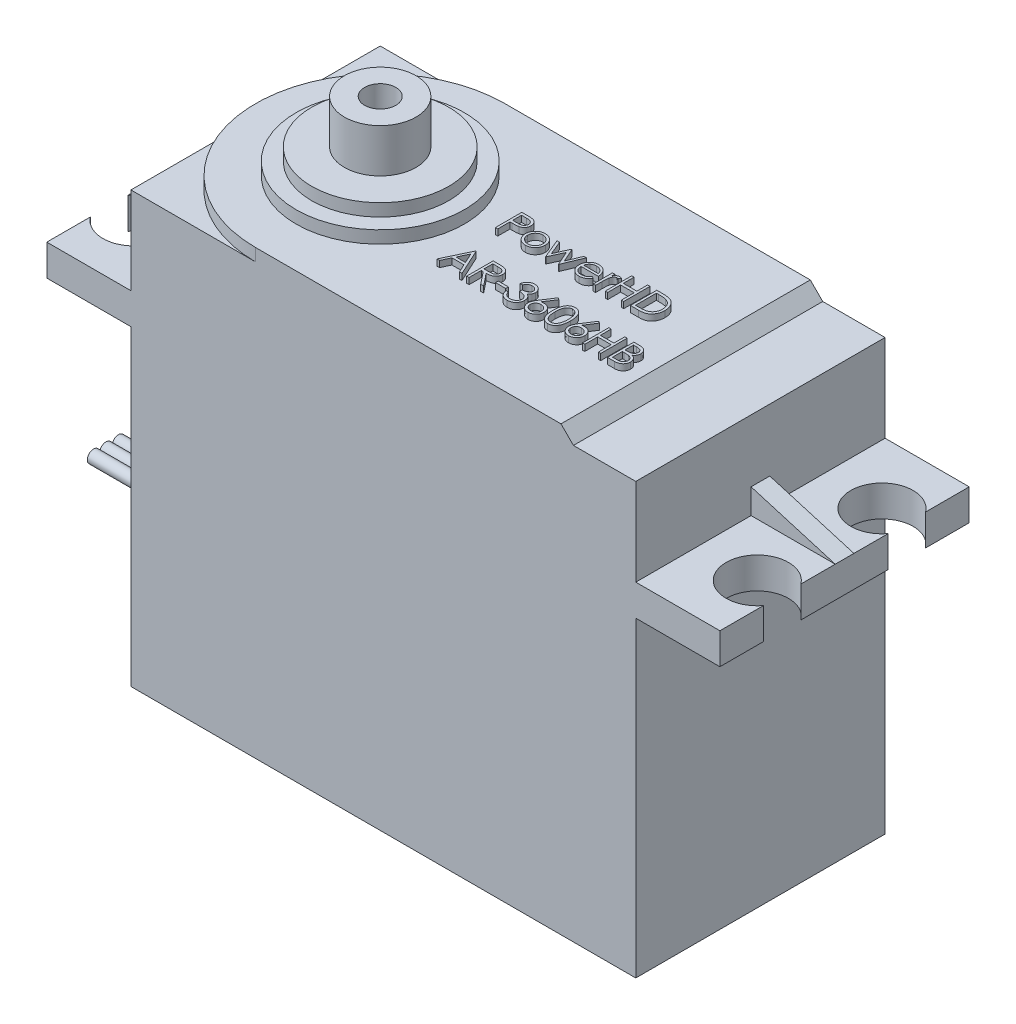
from build123d import *

# Parameters (mm, degrees)
Y_KSEKLIK_EKSTR_ZYON1_DEPTH   = 20
Y_KSEKLIK_EKSTR_ZYON2_DEPTH   = 1
IZIM3_R                       = 6.75
Y_KSEKLIK_EKSTR_ZYON3_DEPTH   = 1
IZIM4_R                       = 5.5
Y_KSEKLIK_EKSTR_ZYON4_DEPTH   = 1
IZIM5_R                       = 2.875
IZIM5_R_2                     = 1.25
Y_KSEKLIK_EKSTR_ZYON5_DEPTH   = 3.5
KES_EKSTR_ZYON1_DEPTH         = 67.306579613
IZIM7_R                       = 2.5
KES_EKSTR_ZYON2_DEPTH         = 3.5
FEDER14_REACH                 = 66.004
IZIM12_WALL_W                 = 137.04885268
IZIM12_WALL_H                 = 1.5
FEDER16_REACH                 = 66.004
IZIM13_WALL_W                 = 137.04885268
IZIM13_WALL_H                 = 1.5
IZIM14_R                      = 2.25
KES_EKSTR_ZYON3_DEPTH         = 7
IZIM15_W                      = 7
IZIM15_H                      = 3
Y_KSEKLIK_EKSTR_ZYON6_DEPTH   = 6
IZIM16_R                      = 0.5
Y_KSEKLIK_EKSTR_ZYON8_DEPTH   = 6
Y_KSEKLIK_EKSTR_ZYON8_2_DEPTH = 6
Y_KSEKLIK_EKSTR_ZYON8_3_DEPTH = 6
PAH1_SIZE                     = 1
IZIM17_W                      = 0.814102564
IZIM17_H                      = 0.217094017
Y_KSEKLIK_EKSTR_ZYON9_DEPTH   = 0.5


with BuildPart() as part:
    # Çizim1 → Yükseklik-Ekstrüzyon1 (new body)
    with BuildSketch(Plane.XY):
        Polygon((0, 0), (0, 26), (-6.75, 26), (-6.75, 28.5), (0, 28.5), (0, 35.5), (40.5, 35.5), (40.5, 28.5), (47.25, 28.5), (47.25, 26), (40.5, 26), (40.5, 0), align=None)
    extrude(amount=Y_KSEKLIK_EKSTR_ZYON1_DEPTH)

    # Çizim2 → Yükseklik-Ekstrüzyon2 (add)
    with BuildSketch(Plane(origin=(0, 35.5, 0), x_dir=(1, 0, 0), z_dir=(0, 1, 0))):
        with BuildLine():
            Line((35.5, 0), (35.5, -20))
            Line((35.5, -20), (10, -20))
            ThreePointArc((10, -20), (0, -10), (10, 0))
            Line((10, 0), (35.5, 0))
        make_face()
    extrude(amount=Y_KSEKLIK_EKSTR_ZYON2_DEPTH)

    # Çizim3 → Yükseklik-Ekstrüzyon3 (add)
    with BuildSketch(Plane(origin=(0, 36.5, 0), x_dir=(1, 0, 0), z_dir=(0, 1, 0))):
        with Locations(Location((10, -10, 0), (0, 0, 270))):
            Circle(IZIM3_R)
    extrude(amount=Y_KSEKLIK_EKSTR_ZYON3_DEPTH)

    # Çizim4 → Yükseklik-Ekstrüzyon4 (add)
    with BuildSketch(Plane(origin=(0, 37.5, 0), x_dir=(1, 0, 0), z_dir=(0, 1, 0))):
        with Locations(Location((10, -10, 0), (0, 0, 270))):
            Circle(IZIM4_R)
    extrude(amount=Y_KSEKLIK_EKSTR_ZYON4_DEPTH)

    # Çizim5 → Yükseklik-Ekstrüzyon5 (add)
    with BuildSketch(Plane(origin=(0, 38.5, 0), x_dir=(1, 0, 0), z_dir=(0, 1, 0))):
        with Locations(Location((10, -10, 0), (0, 0, 270))):
            Circle(IZIM5_R)
        with Locations(Location((10, -10, 0), (0, 0, 270))):
            Circle(IZIM5_R_2, mode=Mode.SUBTRACT)
    extrude(amount=Y_KSEKLIK_EKSTR_ZYON5_DEPTH)

    # Çizim6 → Kes-Ekstrüzyon1 (cut, through all)
    with BuildSketch(Plane.XY.offset(20)):
        Polygon((35.5, 35.5), (35.5, 36.5), (34.5, 36.5), align=None)
    extrude(amount=-KES_EKSTR_ZYON1_DEPTH, mode=Mode.SUBTRACT)

    # Çizim7 → Kes-Ekstrüzyon2 (cut)
    with BuildSketch(Plane(origin=(0, 28.5, 0), x_dir=(1, 0, 0), z_dir=(0, 1, 0))):
        with Locations((-4.75, -5)):
            Circle(IZIM7_R)
        with Locations((-4.75, -15)):
            Circle(IZIM7_R)
        with Locations((45.25, -15)):
            Circle(IZIM7_R)
        with Locations((45.25, -5)):
            Circle(IZIM7_R)
    extrude(amount=-KES_EKSTR_ZYON2_DEPTH, mode=Mode.SUBTRACT)

    # Çizim12 wall → Feder14 (add, up to next)
    with BuildSketch(Plane(origin=(-3.375, 29.5, 10), x_dir=(0.958798112708, 0.284088329691, 0), z_dir=(-0.284088329691, 0.958798112708, 0)), mode=Mode.PRIVATE) as feder14_sk1:
        Rectangle(IZIM12_WALL_W, IZIM12_WALL_H)
    feder14_tool1 = extrude(feder14_sk1.sketch, amount=-FEDER14_REACH, mode=Mode.PRIVATE) - part.part
    add(feder14_tool1.solids().sort_by_distance((-3.375, 29.5, 10))[0])

    # Çizim13 wall → Feder16 (add, up to next)
    with BuildSketch(Plane(origin=(43.875, 29.5, 10), x_dir=(-0.958798112708, 0.284088329691, 0), z_dir=(-0.284088329691, -0.958798112708, 0)), mode=Mode.PRIVATE) as feder16_sk1:
        Rectangle(IZIM13_WALL_W, IZIM13_WALL_H)
    feder16_tool1 = extrude(feder16_sk1.sketch, amount=FEDER16_REACH, mode=Mode.PRIVATE) - part.part
    add(feder16_tool1.solids().sort_by_distance((43.875, 29.5, 10))[0])

    # Çizim14 → Kes-Ekstrüzyon3 (cut)
    with BuildSketch(Plane.ZY):
        with Locations((10, 15)):
            Circle(IZIM14_R)
    extrude(amount=-KES_EKSTR_ZYON3_DEPTH, mode=Mode.SUBTRACT)

    # Çizim15 → Yükseklik-Ekstrüzyon6 (add)
    with BuildSketch(Plane.ZY):
        with Locations((10, 6.5)):
            Rectangle(IZIM15_W, IZIM15_H)
    extrude(amount=Y_KSEKLIK_EKSTR_ZYON6_DEPTH)

    # Pah1
    pah1_edges = [part.edges().sort_by_distance(p)[0] for p in [
        (20.25, 0, 0),
        (0, 0, 10),
        (40.5, 0, 10),
        (20.25, 0, 20),
    ]]
    chamfer(pah1_edges, length=PAH1_SIZE)

    # Çizim17 → Yükseklik-Ekstrüzyon9 (add)
    # profile 1 of 16: a face of its own
    with BuildSketch(Plane(origin=(0, 36.5, 0), x_dir=(1, 0, 0), z_dir=(0, 1, 0))):
        with BuildLine():
            Line((18.731786716, -7.372731881), (19.146894221, -7.372731881))
            add(Edge.make_bspline(
                [(19.146894221, -7.372731881), (19.175445579, -7.372763266), (19.230151248, -7.372823401), (19.308597972, -7.374646604), (19.379844809, -7.377081794), (19.443738135, -7.380457511), (19.500474537, -7.384446877), (19.549797285, -7.390042158), (19.592094064, -7.395884337), (19.617437488, -7.401823949), (19.628995583, -7.404532763)],
                knots=[0, 0, 0, 0, 1.415646017, 2.712440637, 3.8905458, 4.950247383, 5.884950622, 6.709939814, 7.411656543, 8, 8, 8, 8], degree=3))
            add(Edge.make_bspline(
                [(19.628995583, -7.404532763), (19.643626911, -7.408537466), (19.672544797, -7.416452506), (19.714213523, -7.432305567), (19.753857992, -7.451102877), (19.79161422, -7.472525926), (19.827018241, -7.497493862), (19.860598276, -7.524994574), (19.892057978, -7.555662999), (19.921220439, -7.589155161), (19.948002197, -7.624908811), (19.971061577, -7.663457684), (19.990369948, -7.704152901), (20.006930307, -7.746966155), (20.018849229, -7.79225697), (20.027828069, -7.839710649), (20.03352712, -7.889322104), (20.034072955, -7.923224976), (20.034350818, -7.940483617)],
                knots=[0, 0, 0, 0, 0.999701418, 1.975846123, 2.934577507, 3.890451536, 4.834027766, 5.787354733, 6.749476667, 7.726910423, 8.712836071, 9.690891519, 10.682875813, 11.679750201, 12.712814741, 13.765529915, 14.8625177, 16, 16, 16, 16], degree=3))
            add(Edge.make_bspline(
                [(20.034350818, -7.940483617), (20.034095957, -7.95788732), (20.033597303, -7.991938841), (20.027612406, -8.041754765), (20.019550814, -8.089360649), (20.007154978, -8.134650936), (19.990919737, -8.177356663), (19.971874544, -8.218130456), (19.948903551, -8.256278639), (19.922508821, -8.291939705), (19.893146666, -8.325147128), (19.860941318, -8.355660266), (19.826022793, -8.383300509), (19.788502066, -8.408129821), (19.748013348, -8.429572428), (19.705170712, -8.448778037), (19.659601772, -8.464907678), (19.628067966, -8.473392525), (19.612035113, -8.477706507)],
                knots=[0, 0, 0, 0, 1.121902311, 2.195077645, 3.232258892, 4.234102512, 5.217864754, 6.176164875, 7.132989551, 8.084763148, 9.034132444, 9.988522005, 10.94243251, 11.903244335, 12.886203696, 13.894208494, 14.929344452, 16, 16, 16, 16], degree=3))
            add(Edge.make_bspline(
                [(19.612035113, -8.477706507), (19.598774297, -8.480526501), (19.569712447, -8.48670668), (19.521849944, -8.49360608), (19.466123924, -8.49949501), (19.40261045, -8.50391046), (19.331366532, -8.507690445), (19.252353628, -8.510694959), (19.165416639, -8.51234587), (19.10477641, -8.512431016), (19.073116176, -8.512475471)],
                knots=[0, 0, 0, 0, 0.601384939, 1.31797006, 2.144135048, 3.087295005, 4.142315834, 5.309527816, 6.595305764, 8, 8, 8, 8], degree=3))
            Line((19.073116176, -8.512475471), (18.921743981, -8.512475471))
            Line((18.921743981, -8.512475471), (18.921743981, -9.489398548))
            Line((18.921743981, -9.489398548), (18.731786716, -9.489398548))
            Line((18.731786716, -9.489398548), (18.731786716, -7.372731881))
        make_face()
        with BuildLine():
            Line((18.921743981, -7.589825898), (18.921743981, -8.295381454))
            Line((18.921743981, -8.295381454), (19.292330252, -8.300045583))
            add(Edge.make_bspline(
                [(19.292330252, -8.300045583), (19.310424683, -8.300054935), (19.34535561, -8.300072988), (19.395814659, -8.297662877), (19.442628847, -8.29488065), (19.485654376, -8.29080702), (19.524910641, -8.285048926), (19.560463099, -8.279236114), (19.592036075, -8.27082668), (19.628986545, -8.259503681), (19.67016076, -8.240192052), (19.714953991, -8.212161404), (19.752915251, -8.176431642), (19.785764887, -8.13625862), (19.81183368, -8.091567242), (19.830917542, -8.043749361), (19.842130528, -7.993295376), (19.843634083, -7.958770644), (19.844393553, -7.941331641)],
                knots=[0, 0, 0, 0, 1.160613943, 2.240541288, 3.23993089, 4.169200891, 5.011653406, 5.7853311, 6.478053781, 7.106038997, 8.262395093, 9.384106736, 10.481365981, 11.59014053, 12.70357646, 13.786202915, 14.881775077, 16, 16, 16, 16], degree=3))
            add(Edge.make_bspline(
                [(19.844393553, -7.941331641), (19.843629953, -7.92431454), (19.842112009, -7.890486649), (19.830829654, -7.840909018), (19.811870783, -7.793595044), (19.785589891, -7.749463702), (19.753694064, -7.709435235), (19.716622557, -7.674663163), (19.674462632, -7.646710038), (19.635244892, -7.628668006), (19.600409889, -7.617652101), (19.570152466, -7.609944507), (19.535989058, -7.603790688), (19.497908544, -7.598807751), (19.456206078, -7.594542086), (19.410523382, -7.591647709), (19.361033512, -7.589953495), (19.326676643, -7.58986946), (19.30886671, -7.589825898)],
                knots=[0, 0, 0, 0, 1.120700087, 2.227813068, 3.331159281, 4.466773991, 5.599788987, 6.693661531, 7.80175334, 8.91857717, 9.525282508, 10.207424825, 10.974604443, 11.810962634, 12.737642355, 13.736264703, 14.826523623, 16, 16, 16, 16], degree=3))
            Line((19.30886671, -7.589825898), (18.921743981, -7.589825898))
        make_face(mode=Mode.SUBTRACT)
    # profile 2 of 16: a face of its own
    with BuildSketch(Plane(origin=(0, 36.5, 0), x_dir=(1, 0, 0), z_dir=(0, 1, 0))):
        with BuildLine():
            add(Edge.make_bspline(
                [(21.161374055, -7.915466924), (21.190397349, -7.916084925), (21.247304935, -7.917296673), (21.330645894, -7.930247629), (21.410199381, -7.950051987), (21.486270078, -7.977430503), (21.557883743, -8.014128635), (21.626083495, -8.057919016), (21.690682353, -8.109797061), (21.729401042, -8.149927893), (21.749054344, -8.170297987)],
                knots=[0, 0, 0, 0, 1.054011418, 2.066658804, 3.057071809, 4.030435133, 4.997543892, 5.974964718, 6.972108034, 8, 8, 8, 8], degree=3))
            add(Edge.make_bspline(
                [(21.749054344, -8.170297987), (21.765976764, -8.189779778), (21.799494108, -8.228366335), (21.842471947, -8.290932348), (21.879496415, -8.3557266), (21.909167824, -8.423609507), (21.932563053, -8.493988475), (21.94917326, -8.567105405), (21.959053216, -8.642798825), (21.960385486, -8.694205908), (21.96106022, -8.72024123)],
                knots=[0, 0, 0, 0, 1.025258237, 2.030674902, 3.01204498, 3.988269485, 4.97094183, 5.956517959, 6.965070386, 8, 8, 8, 8], degree=3))
            add(Edge.make_bspline(
                [(21.96106022, -8.72024123), (21.960466745, -8.746427455), (21.959294009, -8.798172657), (21.948200489, -8.874384369), (21.930945975, -8.948283143), (21.906252435, -9.019559591), (21.874588245, -9.088431587), (21.835949591, -9.154598314), (21.790065327, -9.218190318), (21.738053387, -9.278667621), (21.680569633, -9.334406236), (21.618208915, -9.382985714), (21.552196713, -9.42460635), (21.481655257, -9.458132182), (21.407228729, -9.484566144), (21.328756597, -9.503132344), (21.246360769, -9.514357743), (21.19010145, -9.515799238), (21.161374055, -9.5165353)],
                knots=[0, 0, 0, 0, 0.998656419, 1.973391657, 2.932242238, 3.890759089, 4.846373663, 5.82037756, 6.809684879, 7.83454468, 8.860553229, 9.859544525, 10.845671541, 11.83227036, 12.833544569, 13.85385346, 14.904124723, 16, 16, 16, 16], degree=3))
            add(Edge.make_bspline(
                [(21.161374055, -9.5165353), (21.132505916, -9.515796767), (21.075966205, -9.514350313), (20.99327954, -9.503175956), (20.91466677, -9.4845747), (20.840142808, -9.458045312), (20.769298068, -9.424605278), (20.702903377, -9.383111542), (20.640491999, -9.334391829), (20.582996085, -9.278671524), (20.530987404, -9.218189313), (20.485102299, -9.154598575), (20.446463864, -9.088431519), (20.414799617, -9.019559609), (20.390106092, -8.948283138), (20.372851574, -8.87438437), (20.361758055, -8.798172657), (20.360585319, -8.746427455), (20.359991844, -8.72024123)],
                knots=[0, 0, 0, 0, 1.099876186, 2.154163076, 3.173186993, 4.173200201, 5.163417411, 6.152872554, 7.150605724, 8.17532212, 9.198891216, 10.186952605, 11.159729845, 12.11414092, 13.071450619, 14.029093627, 15.002601286, 16, 16, 16, 16], degree=3))
            add(Edge.make_bspline(
                [(20.359991844, -8.72024123), (20.360671179, -8.694347414), (20.362016146, -8.643082108), (20.371886168, -8.567530981), (20.388431581, -8.494537798), (20.411854854, -8.424430487), (20.441799755, -8.356845056), (20.478303963, -8.291890706), (20.521720203, -8.229607608), (20.55510424, -8.191070921), (20.57199772, -8.171570022)],
                knots=[0, 0, 0, 0, 1.031353054, 2.041901799, 3.029428768, 4.008703097, 4.981709435, 5.96992636, 6.972712378, 8, 8, 8, 8], degree=3))
            add(Edge.make_bspline(
                [(20.57199772, -8.171570022), (20.591621392, -8.151023273), (20.630214795, -8.110614476), (20.695135216, -8.058887664), (20.763167194, -8.014186038), (20.835572268, -7.978217089), (20.911580473, -7.949890938), (20.991541634, -7.930196555), (21.075165398, -7.917343335), (21.132351454, -7.916098628), (21.161374055, -7.915466924)],
                knots=[0, 0, 0, 0, 1.027980169, 2.021703884, 2.998553061, 3.971491411, 4.943284454, 5.930300938, 6.949603206, 8, 8, 8, 8], degree=3))
        make_face()
        with BuildLine():
            add(Edge.make_bspline(
                [(21.160526032, -8.105424189), (21.140001857, -8.106007537), (21.099483337, -8.107159175), (21.039841969, -8.115918489), (20.982425781, -8.129796265), (20.927125841, -8.149513956), (20.874128637, -8.174973766), (20.823383427, -8.206245013), (20.774740952, -8.242913515), (20.729152751, -8.284921893), (20.687313925, -8.330810618), (20.650739148, -8.379704625), (20.619639203, -8.430810844), (20.593731107, -8.48418242), (20.574434855, -8.540360213), (20.560420694, -8.598708023), (20.551669644, -8.659344727), (20.550528834, -8.700565915), (20.549949109, -8.721513265)],
                knots=[0, 0, 0, 0, 1.021534396, 2.016698045, 2.994645724, 3.958388632, 4.93408049, 5.916473867, 6.921342795, 7.962252576, 8.998418191, 10.008913653, 10.997312074, 11.973003931, 12.956656626, 13.948281152, 14.957379055, 16, 16, 16, 16], degree=3))
            add(Edge.make_bspline(
                [(20.549949109, -8.721513265), (20.550920855, -8.748577586), (20.552849588, -8.802295203), (20.568534231, -8.881404786), (20.5947726, -8.957351906), (20.630203955, -9.02969134), (20.67459724, -9.096621718), (20.726901323, -9.156294472), (20.786554856, -9.207811606), (20.85284674, -9.250556689), (20.924422922, -9.28451997), (21.000173174, -9.308588874), (21.079179689, -9.324235088), (21.133173274, -9.325790218), (21.160526032, -9.326578035)],
                knots=[0, 0, 0, 0, 1.016792936, 2.018143844, 3.017858371, 4.030088057, 5.03801393, 6.028138512, 7.003788237, 7.991172063, 8.984598303, 9.972568034, 10.972917682, 12, 12, 12, 12], degree=3))
            add(Edge.make_bspline(
                [(21.160526032, -9.326578035), (21.187877217, -9.325785628), (21.241867696, -9.324221437), (21.320764437, -9.308667675), (21.396307648, -9.284414508), (21.467809487, -9.250594886), (21.534071195, -9.207649283), (21.594153759, -9.156585379), (21.646011252, -9.096463669), (21.690360623, -9.029602687), (21.726372225, -8.957464055), (21.75248778, -8.881390769), (21.768210129, -8.802298772), (21.770133773, -8.748578782), (21.771102955, -8.721513265)],
                knots=[0, 0, 0, 0, 1.02726834, 2.027799167, 3.010890988, 4.004497153, 4.992059811, 5.971914811, 6.958719428, 7.966827853, 8.981595046, 9.981490638, 10.983022906, 12, 12, 12, 12], degree=3))
            add(Edge.make_bspline(
                [(21.771102955, -8.721513265), (21.77052343, -8.700565789), (21.769383013, -8.659344356), (21.760629106, -8.598709443), (21.746625517, -8.540355002), (21.727290301, -8.484201647), (21.701494779, -8.430672657), (21.669795099, -8.379854679), (21.633369669, -8.330641244), (21.591025982, -8.285070232), (21.545485368, -8.242897139), (21.496823178, -8.206230794), (21.446153215, -8.1751112), (21.393309977, -8.149296188), (21.338002948, -8.129975654), (21.280667207, -8.115838358), (21.221280308, -8.107196191), (21.180906982, -8.106018634), (21.160526032, -8.105424189)],
                knots=[0, 0, 0, 0, 1.042956736, 2.052379634, 3.044323526, 4.02829302, 5.004299113, 5.996692471, 7.007513377, 8.048758398, 9.090003419, 10.095195979, 11.07790575, 12.047570684, 13.018257071, 13.989683339, 14.985167495, 16, 16, 16, 16], degree=3))
        make_face(mode=Mode.SUBTRACT)
    # profile 3 of 16: a face of its own
    with BuildSketch(Plane(origin=(0, 36.5, 0), x_dir=(1, 0, 0), z_dir=(0, 1, 0))):
        Polygon((22.123880733, -7.942603676), (22.327830386, -7.942603676), (22.78873116, -9.055210514), (23.293729157, -7.942603676), (23.32595405, -7.942603676), (23.819927741, -9.055210514), (24.285068633, -7.942603676), (24.484778169, -7.942603676), (23.838160247, -9.489398548), (23.798727154, -9.489398548), (23.304329451, -8.37679171), (22.799755466, -9.489398548), (22.76456249, -9.489398548), align=None)
    # profile 4 of 16: a face of its own
    with BuildSketch(Plane(origin=(0, 36.5, 0), x_dir=(1, 0, 0), z_dir=(0, 1, 0))):
        with BuildLine():
            Line((25.998500124, -9.000937009), (26.167256801, -9.089555466))
            add(Edge.make_bspline(
                [(26.167256801, -9.089555466), (26.153808955, -9.11340929), (26.127644773, -9.159819385), (26.082650035, -9.223580558), (26.035483401, -9.280940843), (25.984015763, -9.330367825), (25.929786957, -9.373457948), (25.872496256, -9.41115749), (25.8118454, -9.443281547), (25.747831519, -9.470346171), (25.679917028, -9.491155722), (25.607937349, -9.505853989), (25.531754588, -9.51493949), (25.479535708, -9.515994885), (25.452796999, -9.5165353)],
                knots=[0, 0, 0, 0, 1.120438281, 2.179929193, 3.190490725, 4.156257408, 5.095198341, 6.022838206, 6.959905092, 7.901321166, 8.864066838, 9.862729781, 10.905609505, 12, 12, 12, 12], degree=3))
            add(Edge.make_bspline(
                [(25.452796999, -9.5165353), (25.423077803, -9.515841532), (25.365104261, -9.514488192), (25.280715938, -9.502820844), (25.201262671, -9.483787561), (25.126748926, -9.457198876), (25.057357183, -9.422469018), (24.992949523, -9.380160189), (24.933187239, -9.33048973), (24.87995355, -9.273027405), (24.832029869, -9.21153403), (24.789741397, -9.147455948), (24.754388569, -9.080954379), (24.725630562, -9.012452681), (24.702404763, -8.942382612), (24.68621728, -8.870106629), (24.676885956, -8.795820347), (24.67545603, -8.745566244), (24.674735434, -8.72024123)],
                knots=[0, 0, 0, 0, 1.145258523, 2.234067595, 3.276747158, 4.290159414, 5.277019952, 6.260822364, 7.254936242, 8.264827045, 9.274100331, 10.257902744, 11.220704747, 12.172965371, 13.118907548, 14.062713208, 15.023725156, 16, 16, 16, 16], degree=3))
            add(Edge.make_bspline(
                [(24.674735434, -8.72024123), (24.675375962, -8.696477213), (24.676645405, -8.649380071), (24.684646881, -8.57967186), (24.698827515, -8.51192132), (24.71828653, -8.446072154), (24.743415141, -8.382234616), (24.774156531, -8.320369853), (24.810558588, -8.260543697), (24.83866349, -8.222804659), (24.85282037, -8.203794915)],
                knots=[0, 0, 0, 0, 1.024358464, 2.0301432, 3.019427413, 4.004406732, 4.986367066, 5.972626655, 6.978780325, 8, 8, 8, 8], degree=3))
            add(Edge.make_bspline(
                [(24.85282037, -8.203794915), (24.871995968, -8.180893265), (24.909739731, -8.135815432), (24.973576194, -8.076586063), (25.042700598, -8.026969113), (25.116246677, -7.985840988), (25.195069211, -7.954590735), (25.278108639, -7.931302816), (25.366310494, -7.918253257), (25.426608413, -7.916410044), (25.457461128, -7.915466924)],
                knots=[0, 0, 0, 0, 1.030682036, 2.02871468, 2.997146059, 3.962720338, 4.930598197, 5.918074684, 6.934738563, 8, 8, 8, 8], degree=3))
            add(Edge.make_bspline(
                [(25.457461128, -7.915466924), (25.489179442, -7.916285801), (25.551403543, -7.917892252), (25.642137254, -7.93278532), (25.727989687, -7.956402817), (25.808926488, -7.989757729), (25.884955861, -8.032792315), (25.955583614, -8.086097143), (26.022017624, -8.1480357), (26.060667098, -8.195668689), (26.080334392, -8.219907362)],
                knots=[0, 0, 0, 0, 1.056321875, 2.072262726, 3.055038591, 4.01806755, 4.982017516, 5.957941055, 6.960871419, 8, 8, 8, 8], degree=3))
            add(Edge.make_bspline(
                [(26.080334392, -8.219907362), (26.093715921, -8.238173337), (26.120389909, -8.274583704), (26.15380125, -8.33395388), (26.182804056, -8.396069335), (26.20598637, -8.461934134), (26.224757878, -8.53076788), (26.238338906, -8.603062657), (26.24630339, -8.678796937), (26.247868936, -8.730399187), (26.248667058, -8.75670624)],
                knots=[0, 0, 0, 0, 0.94817472, 1.890038105, 2.849395472, 3.817997239, 4.812318967, 5.836947057, 6.897266129, 8, 8, 8, 8], degree=3))
            Line((26.248667058, -8.75670624), (24.864692699, -8.75670624))
            add(Edge.make_bspline(
                [(24.864692699, -8.75670624), (24.865623794, -8.777086997), (24.867454755, -8.817164934), (24.875991056, -8.875809169), (24.889446267, -8.931673048), (24.908356605, -8.984337554), (24.93125703, -9.034490536), (24.959309345, -9.081759958), (24.992776599, -9.125930516), (25.03010595, -9.167397309), (25.071657384, -9.204324531), (25.115371236, -9.237375843), (25.161873535, -9.265077323), (25.210797614, -9.287562304), (25.26206436, -9.305164695), (25.315689926, -9.317179996), (25.371568787, -9.325227627), (25.409660159, -9.326122473), (25.429052341, -9.326578035)],
                knots=[0, 0, 0, 0, 1.094153842, 2.151609401, 3.174256925, 4.172055639, 5.149267565, 6.128595816, 7.11444997, 8.118368179, 9.117203808, 10.09244225, 11.054858984, 12.015122123, 12.976791628, 13.957293641, 14.960065497, 16, 16, 16, 16], degree=3))
            add(Edge.make_bspline(
                [(25.429052341, -9.326578035), (25.44801232, -9.326210306), (25.485632557, -9.32548066), (25.541658219, -9.318385647), (25.596775933, -9.306913147), (25.650757575, -9.291255867), (25.702507563, -9.27215939), (25.750432253, -9.249116233), (25.794507431, -9.223625672), (25.835701977, -9.194470297), (25.875659197, -9.158784394), (25.915296796, -9.114252315), (25.957797439, -9.061585096), (25.984400669, -9.021945574), (25.998500124, -9.000937009)],
                knots=[0, 0, 0, 0, 0.99110716, 1.966546729, 2.947904876, 3.932708344, 4.903319531, 5.828989031, 6.710028674, 7.56322171, 8.463672341, 9.504779593, 10.677557249, 12, 12, 12, 12], degree=3))
        make_face()
        with BuildLine():
            add(Edge.make_bspline(
                [(26.058709793, -8.566748975), (26.051757072, -8.541552856), (26.038375323, -8.493058438), (26.010413331, -8.425905138), (25.978922447, -8.366222455), (25.941655971, -8.314467153), (25.899432266, -8.268503124), (25.850661132, -8.228335694), (25.795968948, -8.192402283), (25.735638421, -8.162071962), (25.671750293, -8.136254761), (25.604859882, -8.118943382), (25.536607791, -8.107084278), (25.490443723, -8.105979917), (25.467213398, -8.105424189)],
                knots=[0, 0, 0, 0, 1.154881502, 2.222775134, 3.210006277, 4.132804581, 5.035138423, 5.962687519, 6.919655026, 7.923214229, 8.944639381, 9.960483929, 10.97369054, 12, 12, 12, 12], degree=3))
            add(Edge.make_bspline(
                [(25.467213398, -8.105424189), (25.448254452, -8.105794105), (25.410776602, -8.10652535), (25.355561194, -8.113462047), (25.302535852, -8.124928239), (25.251309321, -8.140630856), (25.202552891, -8.16156082), (25.155263674, -8.18610401), (25.110644101, -8.216064872), (25.082739603, -8.238899989), (25.068642351, -8.250436208)],
                knots=[0, 0, 0, 0, 1.04873581, 2.073130211, 3.073294108, 4.04793562, 5.032784715, 6.005352987, 6.992311501, 8, 8, 8, 8], degree=3))
            add(Edge.make_bspline(
                [(25.068642351, -8.250436208), (25.05854689, -8.259564675), (25.038116138, -8.278038468), (25.01081687, -8.309866607), (24.984678775, -8.34418779), (24.96089128, -8.382315079), (24.93907293, -8.423814313), (24.918656182, -8.468335454), (24.900279637, -8.516216347), (24.889940561, -8.549582536), (24.884621251, -8.566748975)],
                knots=[0, 0, 0, 0, 0.879870761, 1.780643979, 2.707998968, 3.669668524, 4.684282772, 5.740141944, 6.837334558, 8, 8, 8, 8], degree=3))
            Line((24.884621251, -8.566748975), (26.058709793, -8.566748975))
        make_face(mode=Mode.SUBTRACT)
    # profile 5 of 16: a face of its own
    with BuildSketch(Plane(origin=(0, 36.5, 0), x_dir=(1, 0, 0), z_dir=(0, 1, 0))):
        with BuildLine():
            Line((26.574308083, -7.942603676), (26.764265348, -7.942603676))
            Line((26.764265348, -7.942603676), (26.764265348, -8.170297987))
            add(Edge.make_bspline(
                [(26.764265348, -8.170297987), (26.778289026, -8.149097558), (26.805109201, -8.108551901), (26.849687973, -8.054928085), (26.895349511, -8.010529462), (26.94231241, -7.975148763), (26.990922023, -7.948652257), (27.040111513, -7.929243612), (27.090654773, -7.917766855), (27.124619365, -7.916234595), (27.141635808, -7.915466924)],
                knots=[0, 0, 0, 0, 1.2804753, 2.448899062, 3.506932113, 4.484331642, 5.4025378, 6.288909075, 7.142734305, 8, 8, 8, 8], degree=3))
            add(Edge.make_bspline(
                [(27.141635808, -7.915466924), (27.154835538, -7.916186909), (27.181994842, -7.917668325), (27.223108123, -7.928076776), (27.265467734, -7.944694438), (27.29276813, -7.96032162), (27.307000391, -7.968468393)],
                knots=[0, 0, 0, 0, 0.901110191, 1.854092781, 2.881294221, 4, 4, 4, 4], degree=3))
            Line((27.307000391, -7.968468393), (27.2026935, -8.132984953))
            add(Edge.make_bspline(
                [(27.2026935, -8.132984953), (27.193556139, -8.128908697), (27.17621168, -8.121171182), (27.150839157, -8.112013871), (27.127446158, -8.106621865), (27.112542673, -8.105805003), (27.105594809, -8.105424189)],
                knots=[0, 0, 0, 0, 1.180555205, 2.24091978, 3.179933427, 4, 4, 4, 4], degree=3))
            add(Edge.make_bspline(
                [(27.105594809, -8.105424189), (27.090351341, -8.106440212), (27.059259086, -8.108512603), (27.013608937, -8.124804168), (26.969311817, -8.151126575), (26.934131812, -8.180319105), (26.906891973, -8.208469439), (26.887454789, -8.233052045), (26.869624747, -8.260616265), (26.852588471, -8.290690883), (26.837066474, -8.323789409), (26.822579602, -8.359581162), (26.809481147, -8.398107597), (26.80201219, -8.424948454), (26.798186288, -8.438697426)],
                knots=[0, 0, 0, 0, 1.125678352, 2.296057538, 3.5422874, 4.923748041, 5.663163013, 6.437101912, 7.23742474, 8.08941207, 8.991984279, 9.93940061, 10.944477711, 12, 12, 12, 12], degree=3))
            add(Edge.make_bspline(
                [(26.798186288, -8.438697426), (26.795324317, -8.450960288), (26.788985268, -8.478121596), (26.782821814, -8.523689513), (26.776732154, -8.577527631), (26.772440389, -8.639785808), (26.76846224, -8.710308572), (26.766218523, -8.789203358), (26.764341862, -8.876551147), (26.764291627, -8.937616589), (26.764265348, -8.96956014)],
                knots=[0, 0, 0, 0, 0.566838948, 1.255505196, 2.06880316, 3.007127437, 4.065329342, 5.249902469, 6.561414163, 8, 8, 8, 8], degree=3))
            Line((26.764265348, -8.96956014), (26.764265348, -9.489398548))
            Line((26.764265348, -9.489398548), (26.574308083, -9.489398548))
            Line((26.574308083, -9.489398548), (26.574308083, -7.942603676))
        make_face()
    # profile 6 of 16: a face of its own
    with BuildSketch(Plane(origin=(0, 36.5, 0), x_dir=(1, 0, 0), z_dir=(0, 1, 0))):
        Polygon((27.55123116, -7.372731881), (27.741188425, -7.372731881), (27.741188425, -8.24110795), (28.826658511, -8.24110795), (28.826658511, -7.372731881), (29.016615775, -7.372731881), (29.016615775, -9.489398548), (28.826658511, -9.489398548), (28.826658511, -8.458201967), (27.741188425, -8.458201967), (27.741188425, -9.489398548), (27.55123116, -9.489398548), align=None)
    # profile 7 of 16: a face of its own
    with BuildSketch(Plane(origin=(0, 36.5, 0), x_dir=(1, 0, 0), z_dir=(0, 1, 0))):
        with BuildLine():
            Line((29.559350818, -9.489398548), (29.559350818, -7.372731881))
            Line((29.559350818, -7.372731881), (29.986754664, -7.372731881))
            add(Edge.make_bspline(
                [(29.986754664, -7.372731881), (30.023928767, -7.372999531), (30.095748939, -7.373516628), (30.19953361, -7.376795279), (30.29555998, -7.382595227), (30.383512233, -7.391043465), (30.463631823, -7.401416966), (30.53569441, -7.414419591), (30.600072611, -7.42977339), (30.639666034, -7.442863733), (30.65838928, -7.449053997)],
                knots=[0, 0, 0, 0, 1.314313732, 2.53924729, 3.670748893, 4.714932338, 5.66265055, 6.526160246, 7.303039223, 8, 8, 8, 8], degree=3))
            add(Edge.make_bspline(
                [(30.65838928, -7.449053997), (30.682878955, -7.4583859), (30.731302962, -7.476838089), (30.800250127, -7.511645947), (30.865156418, -7.551084347), (30.926369901, -7.595205273), (30.982492305, -7.645257998), (31.035716128, -7.699116331), (31.08386408, -7.758738804), (31.12795624, -7.822888915), (31.167710663, -7.890810966), (31.202266249, -7.962375532), (31.230964616, -8.037219177), (31.254788139, -8.115133766), (31.273563854, -8.196290623), (31.286373879, -8.280784247), (31.294823002, -8.368280709), (31.295672118, -8.427652885), (31.296102955, -8.457777955)],
                knots=[0, 0, 0, 0, 0.984719456, 1.947108742, 2.898477687, 3.838006223, 4.779231079, 5.722358779, 6.681677486, 7.655904652, 8.64651281, 9.637519902, 10.640069247, 11.656948941, 12.698408672, 13.768548281, 14.867775369, 16, 16, 16, 16], degree=3))
            add(Edge.make_bspline(
                [(31.296102955, -8.457777955), (31.295722579, -8.483940704), (31.29497301, -8.535497133), (31.288242423, -8.611479961), (31.278459601, -8.685208644), (31.263313824, -8.756332092), (31.244927543, -8.825473442), (31.221363508, -8.8918958), (31.19436966, -8.956208484), (31.162891877, -9.01754191), (31.128334944, -9.075649474), (31.09124989, -9.130426102), (31.051676269, -9.181090165), (31.00923672, -9.227795088), (30.964479672, -9.270470461), (30.917112101, -9.309472775), (30.86701178, -9.344038882), (30.814403104, -9.375527086), (30.75775135, -9.402995587), (30.695983469, -9.426236593), (30.628836042, -9.445496212), (30.556473888, -9.461565278), (30.478771975, -9.474312028), (30.395654124, -9.482855132), (30.307248039, -9.488632381), (30.246542484, -9.4891382), (30.215296999, -9.489398548)],
                knots=[0, 0, 0, 0, 1.105936401, 2.179363191, 3.223086493, 4.248585256, 5.251745608, 6.245858792, 7.225916811, 8.198733463, 9.158002045, 10.082870192, 10.993790845, 11.873723703, 12.748670949, 13.606408763, 14.465103618, 15.319838547, 16.196477973, 17.123216899, 18.106603292, 19.147568657, 20.255746949, 21.433717677, 22.679120308, 24, 24, 24, 24], degree=3))
            Line((30.215296999, -9.489398548), (29.559350818, -9.489398548))
        make_face()
        with BuildLine():
            Line((29.749308083, -9.272304531), (29.992266817, -9.272304531))
            add(Edge.make_bspline(
                [(29.992266817, -9.272304531), (30.027178737, -9.272154492), (30.094327143, -9.271865911), (30.190882218, -9.26933365), (30.279104519, -9.265195907), (30.359006575, -9.259405265), (30.430543271, -9.251743769), (30.49386411, -9.243201566), (30.548761528, -9.232559298), (30.581980759, -9.222912765), (30.597331587, -9.218455038)],
                knots=[0, 0, 0, 0, 1.375205317, 2.645023457, 3.804390687, 4.853969522, 5.800190428, 6.637939096, 7.370582563, 8, 8, 8, 8], degree=3))
            add(Edge.make_bspline(
                [(30.597331587, -9.218455038), (30.61665274, -9.211650525), (30.654833559, -9.198204023), (30.709794977, -9.173676294), (30.761052785, -9.144622281), (30.809500276, -9.11232662), (30.854450206, -9.075650228), (30.896435267, -9.03539063), (30.935370928, -8.991342933), (30.970854914, -8.943561806), (31.002609936, -8.892344644), (31.030109203, -8.838194969), (31.054209891, -8.781706088), (31.073125993, -8.722010549), (31.087952084, -8.659642024), (31.098453586, -8.594596123), (31.104993919, -8.526884996), (31.105756795, -8.480831092), (31.10614569, -8.457353943)],
                knots=[0, 0, 0, 0, 0.998632004, 1.973411704, 2.929992603, 3.868527914, 4.809262121, 5.754881198, 6.702106254, 7.672490631, 8.653608572, 9.636854334, 10.631411391, 11.644891563, 12.686317036, 13.754757253, 14.855430412, 16, 16, 16, 16], degree=3))
            add(Edge.make_bspline(
                [(31.10614569, -8.457353943), (31.105835273, -8.432598934), (31.105225457, -8.383967498), (31.097560517, -8.312611221), (31.086359386, -8.243982446), (31.070161633, -8.178076585), (31.049520578, -8.114765058), (31.023760961, -8.054398021), (30.994329244, -7.996337934), (30.959311511, -7.941924865), (30.920960176, -7.890463794), (30.878398316, -7.843319631), (30.832302131, -7.800384983), (30.783174388, -7.760991208), (30.729630524, -7.726723175), (30.672931863, -7.696069801), (30.612246624, -7.670055429), (30.570026565, -7.656219164), (30.548570236, -7.649187544)],
                knots=[0, 0, 0, 0, 1.122418816, 2.205001699, 3.251619955, 4.274784885, 5.280384055, 6.268708349, 7.249350384, 8.229342522, 9.199999885, 10.157847722, 11.105861043, 12.055065948, 13.010012805, 13.98527497, 14.976112212, 16, 16, 16, 16], degree=3))
            add(Edge.make_bspline(
                [(30.548570236, -7.649187544), (30.530819781, -7.644279037), (30.493077443, -7.633842206), (30.431488815, -7.622457338), (30.362173939, -7.612415569), (30.284825072, -7.603913803), (30.199530384, -7.597813375), (30.106224278, -7.593234532), (30.004866422, -7.590146236), (29.934603651, -7.589935351), (29.898136208, -7.589825898)],
                knots=[0, 0, 0, 0, 0.674548936, 1.434276114, 2.292660221, 3.240891867, 4.284742987, 5.42552168, 6.663806718, 8, 8, 8, 8], degree=3))
            Line((29.898136208, -7.589825898), (29.749308083, -7.589825898))
            Line((29.749308083, -7.589825898), (29.749308083, -9.272304531))
        make_face(mode=Mode.SUBTRACT)
    # profile 8 of 16: a face of its own
    with BuildSketch(Plane(origin=(0, 36.5, 0), x_dir=(1, 0, 0), z_dir=(0, 1, 0))):
        Polygon((19.600162784, -11.900509659), (20.577085861, -14.017176326), (20.370592138, -14.017176326), (20.057671465, -13.338757522), (19.09813287, -13.338757522), (18.77630795, -14.017176326), (18.568966203, -14.017176326), (19.573026032, -11.900509659), align=None)
        Polygon((19.584474349, -12.313073094), (19.201167725, -13.121663505), (19.957604691, -13.121663505), align=None, mode=Mode.SUBTRACT)
    # profile 9 of 16: a face of its own
    with BuildSketch(Plane(origin=(0, 36.5, 0), x_dir=(1, 0, 0), z_dir=(0, 1, 0))):
        with BuildLine():
            Line((20.957000391, -11.900509659), (21.380588131, -11.900509659))
            add(Edge.make_bspline(
                [(21.380588131, -11.900509659), (21.408855385, -11.900603752), (21.463131644, -11.900784419), (21.54088786, -11.901791809), (21.611540438, -11.904679158), (21.675052436, -11.907163873), (21.731422689, -11.911694713), (21.78082405, -11.9160252), (21.823028991, -11.921694033), (21.848577673, -11.926958741), (21.860145423, -11.929342458)],
                knots=[0, 0, 0, 0, 1.410062039, 2.707475311, 3.878576406, 4.937260626, 5.877586885, 6.699081471, 7.410979367, 8, 8, 8, 8], degree=3))
            add(Edge.make_bspline(
                [(21.860145423, -11.929342458), (21.875631334, -11.933168645), (21.906272799, -11.940739395), (21.95039022, -11.956741154), (21.992429835, -11.975258736), (22.032217014, -11.997008224), (22.069552469, -12.022151067), (22.104821161, -12.050253218), (22.138183132, -12.081160909), (22.168289166, -12.115653408), (22.196676116, -12.15184025), (22.220617809, -12.190970617), (22.241256204, -12.231889731), (22.257687898, -12.275013741), (22.270918863, -12.319924431), (22.280248064, -12.367028609), (22.28584283, -12.416111674), (22.286412429, -12.449590029), (22.286701246, -12.466565348)],
                knots=[0, 0, 0, 0, 1.027469482, 2.033020251, 3.019912614, 3.986113645, 4.951240523, 5.91722682, 6.890402269, 7.87763091, 8.8651537, 9.85103654, 10.82876324, 11.815024772, 12.821070561, 13.842952187, 14.906261191, 16, 16, 16, 16], degree=3))
            add(Edge.make_bspline(
                [(22.286701246, -12.466565348), (22.285812851, -12.494768483), (22.284079365, -12.549800103), (22.26791704, -12.629665494), (22.241442668, -12.704165698), (22.204961441, -12.773206913), (22.158503949, -12.83544335), (22.102669432, -12.890108054), (22.037426743, -12.935852192), (21.976690919, -12.96757365), (21.923039951, -12.987889361), (21.878872185, -13.002183731), (21.830692632, -13.013227872), (21.778962911, -13.023121856), (21.723467748, -13.03059169), (21.664340153, -13.036062726), (21.601537956, -13.039482079), (21.558394805, -13.039991292), (21.536200444, -13.040253249)],
                knots=[0, 0, 0, 0, 1.260483769, 2.459530307, 3.627416485, 4.787058657, 5.939039949, 7.08810263, 8.267026773, 9.491475466, 10.141966685, 10.831826277, 11.566392101, 12.351337768, 13.187381173, 14.07005841, 15.007169909, 16, 16, 16, 16], degree=3))
            Line((21.536200444, -13.040253249), (22.313837998, -14.017176326))
            Line((22.313837998, -14.017176326), (22.078935487, -14.017176326))
            Line((22.078935487, -14.017176326), (21.301297934, -13.040253249))
            Line((21.301297934, -13.040253249), (21.146957656, -13.040253249))
            Line((21.146957656, -13.040253249), (21.146957656, -14.017176326))
            Line((21.146957656, -14.017176326), (20.957000391, -14.017176326))
            Line((20.957000391, -14.017176326), (20.957000391, -11.900509659))
        make_face()
        with BuildLine():
            Line((21.146957656, -12.117603676), (21.146957656, -12.823159232))
            Line((21.146957656, -12.823159232), (21.534504397, -12.826127314))
            add(Edge.make_bspline(
                [(21.534504397, -12.826127314), (21.552598897, -12.826135319), (21.587671191, -12.826150835), (21.638411117, -12.823735551), (21.685655184, -12.820987925), (21.729222687, -12.816785226), (21.769133087, -12.811368935), (21.805366437, -12.804593797), (21.837981883, -12.796700407), (21.876020523, -12.784483233), (21.918496901, -12.765127212), (21.96465926, -12.736966173), (22.003970198, -12.701545801), (22.037182429, -12.661042806), (22.063870228, -12.616510408), (22.082685613, -12.568482413), (22.09462509, -12.518171304), (22.096033306, -12.483592162), (22.096743981, -12.466141336)],
                knots=[0, 0, 0, 0, 1.146690395, 2.22261258, 3.21895312, 4.145990853, 4.996080663, 5.770904154, 6.481378293, 7.121626537, 8.300444488, 9.431385265, 10.535395872, 11.636531494, 12.74115979, 13.810798291, 14.895190096, 16, 16, 16, 16], degree=3))
            add(Edge.make_bspline(
                [(22.096743981, -12.466141336), (22.096016984, -12.449119361), (22.094576341, -12.415388017), (22.082814466, -12.366005633), (22.062924222, -12.319398477), (22.03611982, -12.275756146), (22.003463189, -12.236140772), (21.965170988, -12.202245589), (21.922290227, -12.174275675), (21.882211931, -12.156402311), (21.846389335, -12.145444114), (21.815286636, -12.137732696), (21.780143028, -12.131537232), (21.74078787, -12.126573309), (21.69738917, -12.122306748), (21.64972749, -12.119433053), (21.598119056, -12.117731335), (21.562349246, -12.117647219), (21.543832656, -12.117603676)],
                knots=[0, 0, 0, 0, 1.101028733, 2.181837193, 3.264309656, 4.369019818, 5.486613113, 6.575447106, 7.666700264, 8.788928104, 9.402425223, 10.0903467, 10.862060571, 11.710948788, 12.657782767, 13.684531032, 14.801375019, 16, 16, 16, 16], degree=3))
            Line((21.543832656, -12.117603676), (21.146957656, -12.117603676))
        make_face(mode=Mode.SUBTRACT)
    # profile 10 of 16: a face of its own
    with BuildSketch(Plane(origin=(0, 36.5, 0), x_dir=(1, 0, 0), z_dir=(0, 1, 0))):
        with Locations((22.965120049, -13.203073762)):
            Rectangle(IZIM17_W, IZIM17_H)
    # profile 11 of 16: a face of its own
    with BuildSketch(Plane(origin=(0, 36.5, 0), x_dir=(1, 0, 0), z_dir=(0, 1, 0))):
        with BuildLine():
            Line((23.806359365, -12.388971197), (23.6164021, -12.388971197))
            add(Edge.make_bspline(
                [(23.6164021, -12.388971197), (23.621548352, -12.367663933), (23.631608854, -12.326009975), (23.652592625, -12.266497012), (23.675452174, -12.210179454), (23.702901776, -12.158111829), (23.732842784, -12.10924773), (23.767146525, -12.06469545), (23.804230358, -12.023321895), (23.845248303, -11.986604842), (23.888264208, -11.953356406), (23.933884192, -11.925008157), (23.981190419, -11.900621645), (24.030510647, -11.880531314), (24.081991712, -11.865396831), (24.135168199, -11.854416287), (24.190179458, -11.84728547), (24.227522049, -11.846589532), (24.246483564, -11.846236155)],
                knots=[0, 0, 0, 0, 1.162005537, 2.271625781, 3.343758855, 4.383309926, 5.390229558, 6.379919256, 7.361854164, 8.333198761, 9.295911338, 10.242430842, 11.177959212, 12.116337295, 13.062827104, 14.020064771, 14.994644689, 16, 16, 16, 16], degree=3))
            add(Edge.make_bspline(
                [(24.246483564, -11.846236155), (24.274110746, -11.847070261), (24.328762481, -11.848720278), (24.409052514, -11.86378758), (24.486478257, -11.887630398), (24.560192231, -11.920574033), (24.628662426, -11.961206361), (24.689583834, -12.009565987), (24.742130695, -12.064719851), (24.786214438, -12.125639068), (24.820731223, -12.190745019), (24.846183459, -12.257752733), (24.861678475, -12.326503259), (24.863686622, -12.372923137), (24.864692699, -12.396179397)],
                knots=[0, 0, 0, 0, 1.083050992, 2.142477498, 3.193116406, 4.255571735, 5.30263384, 6.308962982, 7.297363603, 8.282367274, 9.249857812, 10.179914175, 11.08814088, 12, 12, 12, 12], degree=3))
            add(Edge.make_bspline(
                [(24.864692699, -12.396179397), (24.863989003, -12.418559697), (24.86261198, -12.46235447), (24.850919691, -12.526290804), (24.831242999, -12.586550248), (24.803986524, -12.643386475), (24.768703777, -12.696439116), (24.725963622, -12.745827536), (24.675464393, -12.791770789), (24.637195702, -12.818089708), (24.617493847, -12.831639467)],
                knots=[0, 0, 0, 0, 1.024540389, 2.004866551, 2.965041327, 3.920577974, 4.882998113, 5.874504559, 6.905732034, 8, 8, 8, 8], degree=3))
            add(Edge.make_bspline(
                [(24.617493847, -12.831639467), (24.640010194, -12.84251198), (24.684621589, -12.864053573), (24.745430719, -12.906299674), (24.800632101, -12.955077561), (24.831416731, -12.993142879), (24.846884205, -13.012268473)],
                knots=[0, 0, 0, 0, 1.015518401, 2.012035669, 3.001164323, 4, 4, 4, 4], degree=3))
            add(Edge.make_bspline(
                [(24.846884205, -13.012268473), (24.857069207, -13.026212923), (24.877272425, -13.053873472), (24.902210105, -13.098345501), (24.924833713, -13.14331045), (24.942462655, -13.189973519), (24.956114469, -13.237793865), (24.965872927, -13.2868536), (24.971935146, -13.337192785), (24.972803313, -13.371248428), (24.973239707, -13.388366897)],
                knots=[0, 0, 0, 0, 1.025084078, 2.033381695, 3.024893161, 4.013698104, 4.991890475, 5.976764909, 6.982997093, 8, 8, 8, 8], degree=3))
            add(Edge.make_bspline(
                [(24.973239707, -13.388366897), (24.972154454, -13.41800611), (24.969989054, -13.477145052), (24.950634209, -13.56451786), (24.920630011, -13.649925663), (24.87802034, -13.73161378), (24.826090942, -13.80804382), (24.764310084, -13.876428064), (24.693379733, -13.935210077), (24.614273459, -13.98432293), (24.528568339, -14.023582816), (24.436901195, -14.050831841), (24.340592829, -14.068579184), (24.274548416, -14.07048229), (24.240971411, -14.07144983)],
                knots=[0, 0, 0, 0, 0.955779014, 1.907060117, 2.875433937, 3.871313158, 4.872415639, 5.851225146, 6.836215519, 7.83643374, 8.849228613, 9.86973379, 10.916971861, 12, 12, 12, 12], degree=3))
            add(Edge.make_bspline(
                [(24.240971411, -14.07144983), (24.218341644, -14.070924768), (24.173813808, -14.06989162), (24.108352264, -14.062828847), (24.045867236, -14.049929272), (23.986274241, -14.032570607), (23.929520338, -14.010562268), (23.875778713, -13.983155245), (23.824718729, -13.95091448), (23.776822221, -13.913459405), (23.732094897, -13.87156069), (23.691725392, -13.824474527), (23.65504066, -13.773071335), (23.623022969, -13.716754058), (23.594213955, -13.656250498), (23.570518805, -13.59078593), (23.549663247, -13.520945593), (23.539966818, -13.472275721), (23.534991844, -13.447304531)],
                knots=[0, 0, 0, 0, 1.048658725, 2.063410685, 3.046034179, 4.001477787, 4.936774919, 5.862367409, 6.792675028, 7.730719943, 8.675894397, 9.627829632, 10.600096036, 11.597688215, 12.626045268, 13.701542398, 14.82072376, 16, 16, 16, 16], degree=3))
            Line((23.534991844, -13.447304531), (23.724949109, -13.447304531))
            add(Edge.make_bspline(
                [(23.724949109, -13.447304531), (23.729898052, -13.463602267), (23.739524176, -13.495302781), (23.755909775, -13.540926204), (23.77457773, -13.58275036), (23.794604153, -13.621082057), (23.815636833, -13.656298796), (23.839171097, -13.687469355), (23.863463866, -13.715962834), (23.881775665, -13.732016004), (23.890737704, -13.73987264)],
                knots=[0, 0, 0, 0, 1.198163088, 2.33053128, 3.407730985, 4.417276592, 5.372219308, 6.28897303, 7.162600585, 8, 8, 8, 8], degree=3))
            add(Edge.make_bspline(
                [(23.890737704, -13.73987264), (23.902588967, -13.749009585), (23.926254911, -13.76725527), (23.964819508, -13.790539589), (24.005377796, -13.810715066), (24.048808575, -13.826126634), (24.09417465, -13.839175982), (24.142209295, -13.847715534), (24.192488726, -13.853574571), (24.226819707, -13.854091601), (24.244363505, -13.854355813)],
                knots=[0, 0, 0, 0, 0.946170439, 1.889420265, 2.845303464, 3.807233317, 4.801018734, 5.828864929, 6.890507805, 8, 8, 8, 8], degree=3))
            add(Edge.make_bspline(
                [(24.244363505, -13.854355813), (24.264171576, -13.853983337), (24.302904548, -13.853254992), (24.359422487, -13.846556827), (24.413190324, -13.836801767), (24.463611094, -13.821735344), (24.511345257, -13.803120258), (24.555723684, -13.779747174), (24.597328948, -13.752324414), (24.63562816, -13.721155494), (24.670066633, -13.687033924), (24.700389101, -13.651345066), (24.726166872, -13.614239398), (24.746960751, -13.575511582), (24.763380369, -13.535321991), (24.774558305, -13.493557842), (24.782330411, -13.450560924), (24.782963363, -13.421333405), (24.783282442, -13.406599403)],
                knots=[0, 0, 0, 0, 1.217147791, 2.380027433, 3.494444702, 4.572153297, 5.609568379, 6.639424714, 7.649109417, 8.668170816, 9.669597737, 10.625200337, 11.543417969, 12.441394052, 13.322311151, 14.205496177, 15.095365482, 16, 16, 16, 16], degree=3))
            add(Edge.make_bspline(
                [(24.783282442, -13.406599403), (24.782356974, -13.386877307), (24.780510643, -13.347531251), (24.766414502, -13.289644908), (24.743228618, -13.233871702), (24.710769527, -13.1811632), (24.671256968, -13.132313012), (24.625074381, -13.088726925), (24.571838262, -13.052761679), (24.522840532, -13.027912825), (24.479439699, -13.01095707), (24.442298014, -12.999663163), (24.40071664, -12.990099667), (24.355198419, -12.981202245), (24.305400379, -12.973629811), (24.251376733, -12.967314999), (24.193116534, -12.962262188), (24.152784258, -12.960005764), (24.132000391, -12.958842992)],
                knots=[0, 0, 0, 0, 1.07054697, 2.135767047, 3.216561865, 4.33974944, 5.486079747, 6.621378074, 7.775625952, 8.963672916, 9.598146892, 10.304877434, 11.070270905, 11.915000392, 12.823868403, 13.805723172, 14.86925407, 16, 16, 16, 16], degree=3))
            Line((24.132000391, -12.958842992), (24.132000391, -12.741748975))
            add(Edge.make_bspline(
                [(24.132000391, -12.741748975), (24.158187286, -12.741304594), (24.209480982, -12.74043416), (24.284407537, -12.729906459), (24.356055683, -12.715343412), (24.42283757, -12.693036653), (24.483706078, -12.667128474), (24.536513647, -12.636979756), (24.580520445, -12.603467027), (24.615512617, -12.56607302), (24.641837436, -12.525968206), (24.661085071, -12.484169084), (24.672454792, -12.440309295), (24.673972543, -12.410376806), (24.674735434, -12.395331374)],
                knots=[0, 0, 0, 0, 1.321986639, 2.589447074, 3.816329219, 5.01088745, 6.139805852, 7.153945165, 8.075214402, 8.924034688, 9.728124013, 10.488707548, 11.240355623, 12, 12, 12, 12], degree=3))
            add(Edge.make_bspline(
                [(24.674735434, -12.395331374), (24.674484814, -12.38427769), (24.673986217, -12.36228691), (24.66769834, -12.330158892), (24.658249515, -12.299013082), (24.645259393, -12.26898193), (24.627872368, -12.240273717), (24.607064938, -12.212643688), (24.582288992, -12.186249593), (24.553898174, -12.161647686), (24.523411034, -12.138201528), (24.489998075, -12.118296614), (24.454666751, -12.101275553), (24.417377945, -12.08723933), (24.378010649, -12.076680618), (24.336749826, -12.069099418), (24.293516798, -12.064359503), (24.264021512, -12.06367708), (24.249027634, -12.063330172)],
                knots=[0, 0, 0, 0, 0.884392785, 1.759457502, 2.611959086, 3.489218968, 4.37281399, 5.2945488, 6.255912374, 7.266815255, 8.301784654, 9.332968512, 10.37626691, 11.440494194, 12.520033166, 13.637162961, 14.798855837, 16, 16, 16, 16], degree=3))
            add(Edge.make_bspline(
                [(24.249027634, -12.063330172), (24.224926864, -12.064171615), (24.177852453, -12.065815148), (24.109989146, -12.080210304), (24.046900787, -12.103178002), (23.998677879, -12.130593685), (23.963067942, -12.157657043), (23.937621412, -12.181292581), (23.912632342, -12.207559098), (23.889744718, -12.238074401), (23.866598075, -12.270771936), (23.845525412, -12.307313877), (23.82504836, -12.346747011), (23.812709675, -12.374623895), (23.806359365, -12.388971197)],
                knots=[0, 0, 0, 0, 1.472543308, 2.876219568, 4.221790263, 5.565193594, 6.249813518, 6.953379497, 7.687249741, 8.463570142, 9.283606569, 10.136032583, 11.040678096, 12, 12, 12, 12], degree=3))
        make_face()
    # profile 12 of 16: a face of its own
    with BuildSketch(Plane(origin=(0, 36.5, 0), x_dir=(1, 0, 0), z_dir=(0, 1, 0))):
        with BuildLine():
            Line((26.140120049, -11.846236155), (26.286404103, -11.96114334))
            Line((26.286404103, -11.96114334), (25.727132602, -12.816375044))
            add(Edge.make_bspline(
                [(25.727132602, -12.816375044), (25.76436796, -12.810439995), (25.836999736, -12.79886301), (25.910518161, -12.796953205), (25.946346678, -12.79602248)],
                knots=[0, 0, 0, 0, 1.025318673, 2, 2, 2, 2], degree=3))
            add(Edge.make_bspline(
                [(25.946346678, -12.79602248), (25.967859569, -12.796600699), (26.010207054, -12.797738908), (26.072380691, -12.806498189), (26.132124477, -12.820301948), (26.189190785, -12.84042374), (26.243784445, -12.866127545), (26.296218752, -12.896933433), (26.345508062, -12.934432107), (26.392287109, -12.976320913), (26.434757782, -13.022716423), (26.472359492, -13.07194485), (26.503944266, -13.123954907), (26.5295704, -13.17872025), (26.549470017, -13.236156459), (26.56397683, -13.296190048), (26.572552108, -13.358862414), (26.573716571, -13.40148493), (26.574308083, -13.423135861)],
                knots=[0, 0, 0, 0, 1.04369286, 2.054478336, 3.041073146, 4.015093852, 4.984733326, 5.965804835, 6.960378782, 7.985147595, 9.009457201, 10.008161701, 10.986880575, 11.956520048, 12.937015923, 13.931873656, 14.949455224, 16, 16, 16, 16], degree=3))
            add(Edge.make_bspline(
                [(26.574308083, -13.423135861), (26.573447444, -13.45275692), (26.571753908, -13.511044154), (26.554878756, -13.595938639), (26.528656494, -13.676814969), (26.491174846, -13.752381887), (26.444618834, -13.822535822), (26.387845242, -13.884696556), (26.322867513, -13.940135102), (26.249396926, -13.986494105), (26.170328562, -14.024354046), (26.087263306, -14.051547311), (26.001007841, -14.068289219), (25.942464102, -14.070388107), (25.91284975, -14.07144983)],
                knots=[0, 0, 0, 0, 1.031375318, 2.029502543, 3.004789286, 3.987476834, 4.960371455, 5.9300674, 6.912260825, 7.929083631, 8.949397511, 9.960523116, 10.96833055, 12, 12, 12, 12], degree=3))
            add(Edge.make_bspline(
                [(25.91284975, -14.07144983), (25.884367459, -14.070525629), (25.827949029, -14.06869495), (25.744955863, -14.052386978), (25.665210133, -14.025954587), (25.589270555, -13.989539285), (25.51892428, -13.943542375), (25.455989348, -13.888168997), (25.40077956, -13.824602796), (25.354833004, -13.752853634), (25.318390818, -13.675752565), (25.291061673, -13.595357237), (25.275098231, -13.511960581), (25.272867532, -13.455426749), (25.271743981, -13.426951967)],
                knots=[0, 0, 0, 0, 1.012016664, 2.004627821, 2.994792927, 3.992885782, 4.990978636, 5.973936114, 6.964471063, 7.975201453, 8.993600317, 9.990122807, 10.98767138, 12, 12, 12, 12], degree=3))
            add(Edge.make_bspline(
                [(25.271743981, -13.426951967), (25.272458474, -13.405153576), (25.273917332, -13.360645427), (25.284103572, -13.293236229), (25.300471329, -13.22426248), (25.318801812, -13.165749229), (25.338169681, -13.11781488), (25.354288121, -13.079168483), (25.37435049, -13.039398692), (25.395742964, -12.997141778), (25.420391165, -12.953486779), (25.447191582, -12.907704083), (25.47688518, -12.860521813), (25.497701183, -12.82850318), (25.508342538, -12.812134926)],
                knots=[0, 0, 0, 0, 1.173818275, 2.396712641, 3.66331629, 4.989737886, 5.693666774, 6.447286557, 7.243889047, 8.091586357, 8.998013824, 9.943181721, 10.948533338, 12, 12, 12, 12], degree=3))
            Line((25.508342538, -12.812134926), (26.140120049, -11.846236155))
        make_face()
        with BuildLine():
            add(Edge.make_bspline(
                [(25.906489574, -13.013116497), (25.890365264, -13.013587028), (25.858869802, -13.014506112), (25.812661509, -13.019843288), (25.768929209, -13.029893866), (25.727093514, -13.042694457), (25.68793657, -13.060294879), (25.651173795, -13.0816743), (25.616663026, -13.106845203), (25.584765735, -13.135450992), (25.555846224, -13.166770422), (25.530941445, -13.200316276), (25.509458851, -13.235280103), (25.491992227, -13.27195404), (25.478391086, -13.310324066), (25.468552667, -13.350213707), (25.463077304, -13.391890454), (25.462166392, -13.420152491), (25.461701246, -13.434584178)],
                knots=[0, 0, 0, 0, 1.129588631, 2.206414736, 3.251139165, 4.268635594, 5.265702196, 6.250456724, 7.242448911, 8.251968645, 9.246821453, 10.222880186, 11.173611482, 12.116736599, 13.062300278, 14.020270554, 14.989073742, 16, 16, 16, 16], degree=3))
            add(Edge.make_bspline(
                [(25.461701246, -13.434584178), (25.462080045, -13.448886785), (25.462822815, -13.476932068), (25.469567313, -13.518261), (25.479869482, -13.558033112), (25.495194388, -13.596043364), (25.513474458, -13.632871138), (25.537607678, -13.667182477), (25.564348306, -13.701061281), (25.596312351, -13.731905028), (25.63061648, -13.760604987), (25.667265779, -13.785690664), (25.705462517, -13.80715135), (25.745722377, -13.823970442), (25.787474161, -13.837773701), (25.831065734, -13.847487072), (25.876527414, -13.852978628), (25.907323062, -13.853890726), (25.923026032, -13.854355813)],
                knots=[0, 0, 0, 0, 0.989467248, 1.94019797, 2.891935182, 3.827694429, 4.772920941, 5.730924762, 6.725747692, 7.756678648, 8.79901574, 9.819492441, 10.826891316, 11.826466727, 12.835195252, 13.867842842, 14.912794438, 16, 16, 16, 16], degree=3))
            add(Edge.make_bspline(
                [(25.923026032, -13.854355813), (25.938728976, -13.85389069), (25.969524574, -13.85297852), (26.014986619, -13.847487482), (26.05857684, -13.837772195), (26.100333538, -13.823975901), (26.140575261, -13.807131099), (26.178738593, -13.785824176), (26.215041297, -13.760450714), (26.249367945, -13.731954074), (26.281198946, -13.700885731), (26.308580919, -13.667484898), (26.331975065, -13.632593828), (26.350985264, -13.596188438), (26.366141378, -13.558010129), (26.376495789, -13.518267157), (26.383226359, -13.476930456), (26.383971043, -13.448886241), (26.384350818, -13.434584178)],
                knots=[0, 0, 0, 0, 1.087397944, 2.132534446, 3.165364764, 4.174271784, 5.174024072, 6.181601208, 7.194203697, 8.236725232, 9.267838612, 10.269026844, 11.221737037, 12.171628256, 13.107553087, 14.05945871, 15.010357665, 16, 16, 16, 16], degree=3))
            add(Edge.make_bspline(
                [(26.384350818, -13.434584178), (26.384018022, -13.420133664), (26.383364851, -13.391772004), (26.375977111, -13.35023235), (26.365731009, -13.310121392), (26.350259366, -13.271691222), (26.33015917, -13.235093495), (26.305676348, -13.200143336), (26.277353793, -13.166572793), (26.244637662, -13.135389571), (26.209023092, -13.106876814), (26.171155572, -13.081706892), (26.131538845, -13.060464644), (26.090213079, -13.042740825), (26.046704765, -13.029950429), (26.001716321, -13.019879182), (25.954672351, -13.014519771), (25.922755069, -13.013590213), (25.906489574, -13.013116497)],
                knots=[0, 0, 0, 0, 0.978206639, 1.919901502, 2.851605144, 3.780102724, 4.718870031, 5.675451981, 6.667674623, 7.690630536, 8.733308323, 9.756129687, 10.767539656, 11.776269907, 12.797430371, 13.836405707, 14.897401972, 16, 16, 16, 16], degree=3))
        make_face(mode=Mode.SUBTRACT)
    # profile 13 of 16: a face of its own
    with BuildSketch(Plane(origin=(0, 36.5, 0), x_dir=(1, 0, 0), z_dir=(0, 1, 0))):
        with BuildLine():
            add(Edge.make_bspline(
                [(26.7914021, -12.959691016), (26.791600473, -12.925765453), (26.791985815, -12.859864558), (26.796272622, -12.763837655), (26.803393901, -12.673752147), (26.813153169, -12.589603721), (26.825029471, -12.511370654), (26.840883599, -12.439262015), (26.858913246, -12.372944063), (26.879809249, -12.312200538), (26.903387579, -12.25621307), (26.929050203, -12.203946401), (26.957815579, -12.155479613), (26.988039712, -12.11003914), (27.02094606, -12.06836881), (27.055598186, -12.029880152), (27.093348558, -11.995462699), (27.132913902, -11.96410803), (27.17465243, -11.936621921), (27.217374423, -11.912411646), (27.26137394, -11.891728869), (27.306771107, -11.875466558), (27.353157892, -11.862034284), (27.400696452, -11.852848587), (27.449465277, -11.847068932), (27.482383335, -11.846516381), (27.499077715, -11.846236155)],
                knots=[0, 0, 0, 0, 1.646270934, 3.197905019, 4.663502075, 6.030701355, 7.308322542, 8.50163776, 9.611534131, 10.641858119, 11.616356847, 12.558055219, 13.465016945, 14.349605745, 15.204443733, 16.039544428, 16.859896111, 17.680448484, 18.487036065, 19.28249412, 20.06191084, 20.843045899, 21.620316918, 22.403196591, 23.190181807, 24, 24, 24, 24], degree=3))
            add(Edge.make_bspline(
                [(27.499077715, -11.846236155), (27.515911552, -11.846531167), (27.549388757, -11.847117853), (27.598882698, -11.852756618), (27.64723322, -11.862112964), (27.69423419, -11.875369934), (27.740271681, -11.891816844), (27.784985604, -11.912431433), (27.828653696, -11.936427701), (27.870582013, -11.964624046), (27.911230852, -11.996060946), (27.949601763, -12.03159837), (27.985698239, -12.070877486), (28.019973304, -12.113478041), (28.051454546, -12.160217116), (28.08143467, -12.210281792), (28.108269187, -12.264547601), (28.13411349, -12.322109122), (28.156421335, -12.384559049), (28.176539492, -12.451545357), (28.192794869, -12.52385927), (28.206335048, -12.60112138), (28.21682458, -12.683615429), (28.224464321, -12.771164582), (28.228499948, -12.863826437), (28.229259953, -12.927179994), (28.229649964, -12.959691016)],
                knots=[0, 0, 0, 0, 0.810914788, 1.612654377, 2.396697861, 3.181598691, 3.963628158, 4.749916497, 5.551656086, 6.361998678, 7.18212741, 8.025565596, 8.878627764, 9.750805457, 10.657531673, 11.591944965, 12.560506719, 13.57287815, 14.630710178, 15.753379473, 16.941251878, 18.199788006, 19.531962791, 20.947069417, 22.433333509, 24, 24, 24, 24], degree=3))
            add(Edge.make_bspline(
                [(28.229649964, -12.959691016), (28.22925591, -12.992060236), (28.228488113, -13.055130343), (28.224509562, -13.147375266), (28.216672675, -13.234459797), (28.206869492, -13.316592791), (28.193292005, -13.393432398), (28.176597452, -13.465244517), (28.158061304, -13.532339265), (28.135180262, -13.594166985), (28.110136642, -13.651590169), (28.082888976, -13.705212683), (28.053697224, -13.755508488), (28.021893554, -13.802075002), (27.987994585, -13.845242095), (27.951274779, -13.8842478), (27.912769235, -13.920031968), (27.872000774, -13.951873667), (27.82941855, -13.979744001), (27.785900442, -14.004668567), (27.740674301, -14.024766435), (27.694765039, -14.042023341), (27.647515979, -14.055207424), (27.598986019, -14.064323518), (27.54942201, -14.070716969), (27.515917254, -14.071204697), (27.499077715, -14.07144983)],
                knots=[0, 0, 0, 0, 1.561518951, 3.042555995, 4.452378317, 5.7783523, 7.031515105, 8.214008947, 9.334062868, 10.386615937, 11.391082383, 12.354592575, 13.286541444, 14.194233754, 15.072674879, 15.931287219, 16.775624067, 17.606195743, 18.42308326, 19.229000347, 20.022332153, 20.807536673, 21.593273796, 22.3848459, 23.188221202, 24, 24, 24, 24], degree=3))
            add(Edge.make_bspline(
                [(27.499077715, -14.07144983), (27.482383798, -14.071167796), (27.449466653, -14.07061168), (27.400691139, -14.064858138), (27.353348899, -14.055608), (27.307206319, -14.042656054), (27.262026665, -14.026802319), (27.218425577, -14.006147473), (27.175918264, -13.982359726), (27.134618132, -13.955269162), (27.095301254, -13.924231763), (27.057746383, -13.889902883), (27.022896967, -13.851425868), (26.990461109, -13.809408267), (26.959633922, -13.764236639), (26.931277016, -13.715294242), (26.905047975, -13.66277514), (26.881073102, -13.606340022), (26.85981653, -13.545165376), (26.841040058, -13.478551349), (26.82621483, -13.405909988), (26.813525138, -13.327824723), (26.803289916, -13.243960013), (26.7963023, -13.154270328), (26.791983505, -13.058811558), (26.791599438, -12.993334124), (26.7914021, -12.959691016)],
                knots=[0, 0, 0, 0, 0.810891512, 1.598919785, 2.382837074, 3.152667961, 3.926044502, 4.706494248, 5.493654104, 6.291793342, 7.103789334, 7.925228297, 8.761435821, 9.622817696, 10.50288917, 11.416980706, 12.369136599, 13.353924996, 14.394355917, 15.514179734, 16.714354668, 17.994756427, 19.357759367, 20.818452758, 22.365282078, 24, 24, 24, 24], degree=3))
        make_face()
        with BuildLine():
            add(Edge.make_bspline(
                [(26.981359365, -12.958842992), (26.981431602, -12.987114825), (26.9815718, -13.041984899), (26.98523436, -13.121718681), (26.990223786, -13.196086451), (26.996659237, -13.265182637), (27.006216258, -13.328773359), (27.016924649, -13.387295977), (27.029956112, -13.440440782), (27.045374528, -13.488572458), (27.062936268, -13.532507848), (27.082110766, -13.573390487), (27.102709394, -13.611703325), (27.125762404, -13.647102221), (27.150869133, -13.679702616), (27.177462485, -13.710081519), (27.206534952, -13.737173027), (27.246753882, -13.769664982), (27.299849845, -13.803240839), (27.366748882, -13.832478713), (27.435491231, -13.850852865), (27.482149368, -13.853189517), (27.505437891, -13.854355813)],
                knots=[0, 0, 0, 0, 1.459021318, 2.831673884, 4.118529203, 5.306027144, 6.411944654, 7.436330062, 8.375795394, 9.233974572, 10.042671642, 10.816086306, 11.563610507, 12.285937304, 12.993564865, 13.685989202, 14.367179055, 15.041617293, 16.353048772, 17.594441528, 18.799311195, 20, 20, 20, 20], degree=3))
            add(Edge.make_bspline(
                [(27.505437891, -13.854355813), (27.528877054, -13.853389536), (27.575706988, -13.851458977), (27.644125997, -13.832833074), (27.710547161, -13.804730067), (27.762600191, -13.771499909), (27.802201539, -13.739853728), (27.830575147, -13.712872489), (27.856617434, -13.682661083), (27.881317165, -13.650064842), (27.903970987, -13.614461007), (27.924571075, -13.576020783), (27.943369099, -13.534637423), (27.954078855, -13.505748104), (27.959554477, -13.490977741)],
                knots=[0, 0, 0, 0, 1.353760809, 2.704726607, 4.075137775, 5.516104923, 6.260822281, 7.007110065, 7.778089737, 8.566572457, 9.372053459, 10.217411131, 11.088608312, 12, 12, 12, 12], degree=3))
            add(Edge.make_bspline(
                [(27.959554477, -13.490977741), (27.965935785, -13.472091185), (27.978892575, -13.433743375), (27.995591124, -13.374256785), (28.008741913, -13.311843685), (28.020573091, -13.246877067), (28.028648511, -13.178877819), (28.035148379, -13.108056339), (28.038976937, -13.03435923), (28.039451525, -12.984287973), (28.039692699, -12.958842992)],
                knots=[0, 0, 0, 0, 0.884706709, 1.796334032, 2.740027952, 3.714592787, 4.726048262, 5.777819803, 6.87074269, 8, 8, 8, 8], degree=3))
            add(Edge.make_bspline(
                [(28.039692699, -12.958842992), (28.039359965, -12.933402127), (28.038709067, -12.883634356), (28.036221084, -12.810749552), (28.029796351, -12.74152381), (28.022660693, -12.675658905), (28.012139517, -12.613519437), (28.00079551, -12.554585204), (27.985554777, -12.499586328), (27.969274722, -12.447661723), (27.950641769, -12.399401328), (27.930130825, -12.354580133), (27.908225285, -12.312981752), (27.884432597, -12.274720316), (27.859035207, -12.239624445), (27.831362785, -12.208397809), (27.802512997, -12.180072595), (27.762104509, -12.14774047), (27.709203391, -12.114773873), (27.64337769, -12.084435532), (27.574875919, -12.067013374), (27.528567211, -12.064557021), (27.505437891, -12.063330172)],
                knots=[0, 0, 0, 0, 1.31362396, 2.569729283, 3.763502607, 4.902122613, 5.988968491, 7.01645872, 7.998833611, 8.933434873, 9.825090667, 10.667526885, 11.477055099, 12.250526234, 12.991942729, 13.710640831, 14.402115721, 15.076753259, 16.378508321, 17.609869233, 18.806226677, 20, 20, 20, 20], degree=3))
            add(Edge.make_bspline(
                [(27.505437891, -12.063330172), (27.482027199, -12.064558713), (27.435163168, -12.067018035), (27.365949405, -12.084370621), (27.299604392, -12.114616558), (27.246843165, -12.147849659), (27.206406494, -12.179501876), (27.177932674, -12.206949875), (27.151234751, -12.236974038), (27.126640475, -12.269874244), (27.103605528, -12.305231871), (27.082450344, -12.343325076), (27.063389864, -12.384346901), (27.045800644, -12.428262555), (27.030335196, -12.476390078), (27.017578371, -12.529469422), (27.005793344, -12.587805899), (26.997450491, -12.65174103), (26.990033838, -12.720854523), (26.985267499, -12.795407949), (26.981559548, -12.875275455), (26.981427429, -12.930429232), (26.981359365, -12.958842992)],
                knots=[0, 0, 0, 0, 1.207732386, 2.417664972, 3.655092373, 4.956220595, 5.625982001, 6.301752483, 6.994047911, 7.697131622, 8.419323945, 9.170223765, 9.943494443, 10.752040957, 11.610060368, 12.549350801, 13.567764191, 14.679664412, 15.874934091, 17.154273443, 18.533957287, 20, 20, 20, 20], degree=3))
        make_face(mode=Mode.SUBTRACT)
    # profile 14 of 16: a face of its own
    with BuildSketch(Plane(origin=(0, 36.5, 0), x_dir=(1, 0, 0), z_dir=(0, 1, 0))):
        with BuildLine():
            Line((29.396530305, -11.846236155), (29.54281436, -11.96114334))
            Line((29.54281436, -11.96114334), (28.983542859, -12.816375044))
            add(Edge.make_bspline(
                [(28.983542859, -12.816375044), (29.020778217, -12.810439995), (29.093409993, -12.79886301), (29.166928417, -12.796953205), (29.202756935, -12.79602248)],
                knots=[0, 0, 0, 0, 1.025318673, 2, 2, 2, 2], degree=3))
            add(Edge.make_bspline(
                [(29.202756935, -12.79602248), (29.224269825, -12.796600699), (29.26661731, -12.797738908), (29.328790948, -12.806498189), (29.388534733, -12.820301948), (29.445601041, -12.84042374), (29.500194702, -12.866127545), (29.552629008, -12.896933433), (29.601918319, -12.934432107), (29.648697365, -12.976320913), (29.691168039, -13.022716423), (29.728769748, -13.07194485), (29.760354522, -13.123954907), (29.785980656, -13.17872025), (29.805880273, -13.236156459), (29.820387087, -13.296190048), (29.828962364, -13.358862414), (29.830126828, -13.40148493), (29.83071834, -13.423135861)],
                knots=[0, 0, 0, 0, 1.04369286, 2.054478336, 3.041073146, 4.015093852, 4.984733326, 5.965804835, 6.960378782, 7.985147595, 9.009457201, 10.008161701, 10.986880575, 11.956520048, 12.937015923, 13.931873656, 14.949455224, 16, 16, 16, 16], degree=3))
            add(Edge.make_bspline(
                [(29.83071834, -13.423135861), (29.8298577, -13.45275692), (29.828164165, -13.511044154), (29.811289012, -13.595938639), (29.785066751, -13.676814969), (29.747585103, -13.752381887), (29.70102909, -13.822535822), (29.644255498, -13.884696556), (29.57927777, -13.940135102), (29.505807182, -13.986494105), (29.426738818, -14.024354046), (29.343673563, -14.051547311), (29.257418098, -14.068289219), (29.198874359, -14.070388107), (29.169260006, -14.07144983)],
                knots=[0, 0, 0, 0, 1.031375318, 2.029502543, 3.004789286, 3.987476834, 4.960371455, 5.9300674, 6.912260825, 7.929083631, 8.949397511, 9.960523116, 10.96833055, 12, 12, 12, 12], degree=3))
            add(Edge.make_bspline(
                [(29.169260006, -14.07144983), (29.140777716, -14.070525629), (29.084359285, -14.06869495), (29.001366119, -14.052386978), (28.92162039, -14.025954587), (28.845680812, -13.989539285), (28.775334536, -13.943542375), (28.712399604, -13.888168997), (28.657189816, -13.824602796), (28.61124326, -13.752853634), (28.574801075, -13.675752565), (28.547471929, -13.595357237), (28.531508487, -13.511960581), (28.529277788, -13.455426749), (28.528154237, -13.426951967)],
                knots=[0, 0, 0, 0, 1.012016664, 2.004627821, 2.994792927, 3.992885782, 4.990978636, 5.973936114, 6.964471063, 7.975201453, 8.993600317, 9.990122807, 10.98767138, 12, 12, 12, 12], degree=3))
            add(Edge.make_bspline(
                [(28.528154237, -13.426951967), (28.52886873, -13.405153576), (28.530327588, -13.360645427), (28.540513829, -13.293236229), (28.556881586, -13.22426248), (28.575212068, -13.165749229), (28.594579937, -13.11781488), (28.610698378, -13.079168483), (28.630760747, -13.039398692), (28.65215322, -12.997141778), (28.676801422, -12.953486779), (28.703601838, -12.907704083), (28.733295437, -12.860521813), (28.75411144, -12.82850318), (28.764752795, -12.812134926)],
                knots=[0, 0, 0, 0, 1.173818275, 2.396712641, 3.66331629, 4.989737886, 5.693666774, 6.447286557, 7.243889047, 8.091586357, 8.998013824, 9.943181721, 10.948533338, 12, 12, 12, 12], degree=3))
            Line((28.764752795, -12.812134926), (29.396530305, -11.846236155))
        make_face()
        with BuildLine():
            add(Edge.make_bspline(
                [(29.16289983, -13.013116497), (29.14677552, -13.013587028), (29.115280059, -13.014506112), (29.069071765, -13.019843288), (29.025339465, -13.029893866), (28.98350377, -13.042694457), (28.944346826, -13.060294879), (28.907584051, -13.0816743), (28.873073282, -13.106845203), (28.841175991, -13.135450992), (28.81225648, -13.166770422), (28.787351701, -13.200316276), (28.765869107, -13.235280103), (28.748402483, -13.27195404), (28.734801342, -13.310324066), (28.724962924, -13.350213707), (28.71948756, -13.391890454), (28.718576649, -13.420152491), (28.718111502, -13.434584178)],
                knots=[0, 0, 0, 0, 1.129588631, 2.206414736, 3.251139165, 4.268635594, 5.265702196, 6.250456724, 7.242448911, 8.251968645, 9.246821453, 10.222880186, 11.173611482, 12.116736599, 13.062300278, 14.020270554, 14.989073742, 16, 16, 16, 16], degree=3))
            add(Edge.make_bspline(
                [(28.718111502, -13.434584178), (28.718490302, -13.448886785), (28.719233071, -13.476932068), (28.725977569, -13.518261), (28.736279738, -13.558033112), (28.751604644, -13.596043364), (28.769884715, -13.632871138), (28.794017935, -13.667182477), (28.820758562, -13.701061281), (28.852722608, -13.731905028), (28.887026737, -13.760604987), (28.923676035, -13.785690664), (28.961872773, -13.80715135), (29.002132633, -13.823970442), (29.043884418, -13.837773701), (29.087475991, -13.847487072), (29.13293767, -13.852978628), (29.163733318, -13.853890726), (29.179436288, -13.854355813)],
                knots=[0, 0, 0, 0, 0.989467248, 1.94019797, 2.891935182, 3.827694429, 4.772920941, 5.730924762, 6.725747692, 7.756678648, 8.79901574, 9.819492441, 10.826891316, 11.826466727, 12.835195252, 13.867842842, 14.912794438, 16, 16, 16, 16], degree=3))
            add(Edge.make_bspline(
                [(29.179436288, -13.854355813), (29.195139233, -13.85389069), (29.22593483, -13.85297852), (29.271396875, -13.847487482), (29.314987097, -13.837772195), (29.356743795, -13.823975901), (29.396985517, -13.807131099), (29.435148849, -13.785824176), (29.471451553, -13.760450714), (29.505778201, -13.731954074), (29.537609202, -13.700885731), (29.564991176, -13.667484898), (29.588385321, -13.632593828), (29.60739552, -13.596188438), (29.622551635, -13.558010129), (29.632906046, -13.518267157), (29.639636616, -13.476930456), (29.640381299, -13.448886241), (29.640761075, -13.434584178)],
                knots=[0, 0, 0, 0, 1.087397944, 2.132534446, 3.165364764, 4.174271784, 5.174024072, 6.181601208, 7.194203697, 8.236725232, 9.267838612, 10.269026844, 11.221737037, 12.171628256, 13.107553087, 14.05945871, 15.010357665, 16, 16, 16, 16], degree=3))
            add(Edge.make_bspline(
                [(29.640761075, -13.434584178), (29.640428278, -13.420133664), (29.639775108, -13.391772004), (29.632387367, -13.35023235), (29.622141265, -13.310121392), (29.606669623, -13.271691222), (29.586569427, -13.235093495), (29.562086604, -13.200143336), (29.53376405, -13.166572793), (29.501047919, -13.135389571), (29.465433349, -13.106876814), (29.427565828, -13.081706892), (29.387949101, -13.060464644), (29.346623336, -13.042740825), (29.303115021, -13.029950429), (29.258126578, -13.019879182), (29.211082607, -13.014519771), (29.179165325, -13.013590213), (29.16289983, -13.013116497)],
                knots=[0, 0, 0, 0, 0.978206639, 1.919901502, 2.851605144, 3.780102724, 4.718870031, 5.675451981, 6.667674623, 7.690630536, 8.733308323, 9.756129687, 10.767539656, 11.776269907, 12.797430371, 13.836405707, 14.897401972, 16, 16, 16, 16], degree=3))
        make_face(mode=Mode.SUBTRACT)
    # profile 15 of 16: a face of its own
    with BuildSketch(Plane(origin=(0, 36.5, 0), x_dir=(1, 0, 0), z_dir=(0, 1, 0))):
        Polygon((30.237769622, -11.900509659), (30.427726887, -11.900509659), (30.427726887, -12.768885727), (31.513196972, -12.768885727), (31.513196972, -11.900509659), (31.703154237, -11.900509659), (31.703154237, -14.017176326), (31.513196972, -14.017176326), (31.513196972, -12.985979745), (30.427726887, -12.985979745), (30.427726887, -14.017176326), (30.237769622, -14.017176326), align=None)
    # profile 16 of 16: a face of its own
    with BuildSketch(Plane(origin=(0, 36.5, 0), x_dir=(1, 0, 0), z_dir=(0, 1, 0))):
        with BuildLine():
            Line((32.24588928, -11.900509659), (32.658876726, -11.900509659))
            add(Edge.make_bspline(
                [(32.658876726, -11.900509659), (32.679092996, -11.900615946), (32.718277159, -11.900821957), (32.775257489, -11.904016994), (32.828627007, -11.908373499), (32.878401193, -11.915285983), (32.924557047, -11.923626725), (32.967233666, -11.933727347), (33.006295341, -11.94583868), (33.052930186, -11.965098098), (33.106101253, -11.993717347), (33.163673614, -12.036007479), (33.212903797, -12.087734255), (33.255349808, -12.146083289), (33.289096199, -12.210270161), (33.313510012, -12.278765003), (33.328966442, -12.350684342), (33.330556019, -12.400059026), (33.331359365, -12.425012196)],
                knots=[0, 0, 0, 0, 1.001505555, 1.941167018, 2.826882275, 3.653841531, 4.429895133, 5.150066043, 5.825578002, 6.45369114, 7.647487171, 8.808567382, 9.977351308, 11.170798116, 12.373658725, 13.556498008, 14.765093433, 16, 16, 16, 16], degree=3))
            add(Edge.make_bspline(
                [(33.331359365, -12.425012196), (33.330698228, -12.44838779), (33.329399032, -12.494323035), (33.316975554, -12.56150852), (33.297526007, -12.625462828), (33.270489975, -12.685952557), (33.235352101, -12.74161098), (33.193709213, -12.792887088), (33.143467528, -12.83760987), (33.105825188, -12.862612483), (33.086704584, -12.875312677)],
                knots=[0, 0, 0, 0, 1.044552857, 2.05264487, 3.044412934, 4.028983338, 5.005914585, 5.980388656, 6.974128949, 8, 8, 8, 8], degree=3))
            add(Edge.make_bspline(
                [(33.086704584, -12.875312677), (33.110750176, -12.884544367), (33.15675535, -12.902206877), (33.220065462, -12.933434038), (33.274611869, -12.967398743), (33.320813952, -13.004489909), (33.360327677, -13.04447), (33.394831122, -13.087925236), (33.424271763, -13.135422484), (33.44949815, -13.186466527), (33.469182398, -13.240536153), (33.483924016, -13.297124194), (33.492370997, -13.356027735), (33.493573047, -13.396114607), (33.494179878, -13.416351673)],
                knots=[0, 0, 0, 0, 1.27268992, 2.434971085, 3.483601985, 4.442670788, 5.356604649, 6.2567628, 7.179492994, 8.113709626, 9.066344395, 10.018646069, 10.999752585, 12, 12, 12, 12], degree=3))
            add(Edge.make_bspline(
                [(33.494179878, -13.416351673), (33.493589119, -13.437014496), (33.492426783, -13.477669178), (33.483851277, -13.537392521), (33.469331483, -13.594466894), (33.449331314, -13.649261457), (33.42322839, -13.701670205), (33.391461479, -13.751752512), (33.353584295, -13.799005179), (33.311212941, -13.843953274), (33.263278215, -13.884368174), (33.211561544, -13.920361007), (33.155411627, -13.94996172), (33.095750659, -13.974827124), (33.031909382, -13.993821001), (32.964174472, -14.007109177), (32.892604346, -14.016062699), (32.843491783, -14.016798818), (32.818305145, -14.017176326)],
                knots=[0, 0, 0, 0, 0.978564426, 1.925352924, 2.850884081, 3.763762016, 4.682927383, 5.618979971, 6.567305752, 7.547517671, 8.540179244, 9.531824382, 10.526200242, 11.540722885, 12.589160233, 13.674978461, 14.80764778, 16, 16, 16, 16], degree=3))
            Line((32.818305145, -14.017176326), (32.24588928, -14.017176326))
            Line((32.24588928, -14.017176326), (32.24588928, -11.900509659))
        make_face()
        with BuildLine():
            Line((32.435846545, -12.117603676), (32.435846545, -12.79602248))
            Line((32.435846545, -12.79602248), (32.563474082, -12.79602248))
            add(Edge.make_bspline(
                [(32.563474082, -12.79602248), (32.582130258, -12.795780621), (32.618177793, -12.795313302), (32.670380778, -12.793974651), (32.718837336, -12.790226311), (32.763463826, -12.786479047), (32.804189971, -12.780386321), (32.840925544, -12.773133942), (32.874247076, -12.765463804), (32.912673373, -12.7524194), (32.956260347, -12.733140996), (33.002726081, -12.703222314), (33.043689308, -12.66758711), (33.078279988, -12.626468767), (33.106589782, -12.58119255), (33.126252839, -12.532480865), (33.139586196, -12.481547737), (33.140790598, -12.446581461), (33.1414021, -12.428828302)],
                knots=[0, 0, 0, 0, 1.156816544, 2.235205308, 3.236616184, 4.169592532, 5.011045266, 5.787822928, 6.49130361, 7.128639758, 8.301311294, 9.436451833, 10.541879658, 11.654887649, 12.756523258, 13.837046038, 14.901820046, 16, 16, 16, 16], degree=3))
            add(Edge.make_bspline(
                [(33.1414021, -12.428828302), (33.141083887, -12.417080336), (33.140459676, -12.394035416), (33.13534744, -12.360441283), (33.126658479, -12.328846252), (33.115498025, -12.298817337), (33.099902008, -12.271293504), (33.081539343, -12.245323095), (33.059353235, -12.221790528), (33.034100003, -12.199795641), (33.005066216, -12.180295379), (32.972269197, -12.163216442), (32.935265221, -12.149463686), (32.894677923, -12.137419156), (32.849882551, -12.128959569), (32.801396035, -12.121912044), (32.748821229, -12.118324147), (32.712447762, -12.11784919), (32.69364569, -12.117603676)],
                knots=[0, 0, 0, 0, 0.91205012, 1.789085906, 2.630437955, 3.453916878, 4.269457761, 5.079663411, 5.91843418, 6.774407191, 7.675494373, 8.627863946, 9.638891023, 10.736472738, 11.911756761, 13.175263542, 14.539845004, 16, 16, 16, 16], degree=3))
            Line((32.69364569, -12.117603676), (32.435846545, -12.117603676))
        make_face(mode=Mode.SUBTRACT)
        with BuildLine():
            Line((32.435846545, -13.013116497), (32.435846545, -13.800082309))
            Line((32.435846545, -13.800082309), (32.706366043, -13.800082309))
            add(Edge.make_bspline(
                [(32.706366043, -13.800082309), (32.725729869, -13.799850233), (32.763051092, -13.799402937), (32.816936122, -13.797942707), (32.866879237, -13.794621188), (32.912652538, -13.789392507), (32.954750288, -13.783720778), (32.99266747, -13.776093956), (33.026711449, -13.767355775), (33.066186864, -13.753848919), (33.110638986, -13.732865815), (33.158542694, -13.701228163), (33.201133788, -13.663537401), (33.23730173, -13.619915372), (33.266942919, -13.572483093), (33.28850598, -13.522199953), (33.301805212, -13.469896801), (33.303415191, -13.43423598), (33.304222613, -13.416351673)],
                knots=[0, 0, 0, 0, 1.160039823, 2.235823828, 3.228722157, 4.157150951, 4.99529583, 5.772374946, 6.472645482, 7.099169577, 8.269452708, 9.405989375, 10.527446681, 11.663510218, 12.788923519, 13.866172445, 14.929861265, 16, 16, 16, 16], degree=3))
            add(Edge.make_bspline(
                [(33.304222613, -13.416351673), (33.304055636, -13.405167605), (33.303724374, -13.382979869), (33.298728669, -13.350373636), (33.291463138, -13.318789417), (33.282070319, -13.28814145), (33.268390927, -13.258983837), (33.252421254, -13.230739908), (33.233696978, -13.203372328), (33.204520744, -13.168772536), (33.162083401, -13.128908438), (33.101784542, -13.089878615), (33.033221295, -13.058402084), (32.98349324, -13.045037163), (32.957805012, -13.03813319)],
                knots=[0, 0, 0, 0, 0.723448775, 1.435228256, 2.130040452, 2.821711965, 3.505591119, 4.210454504, 4.921174351, 5.648778258, 7.137944449, 8.670945889, 10.280296675, 12, 12, 12, 12], degree=3))
            add(Edge.make_bspline(
                [(32.957805012, -13.03813319), (32.947506463, -13.036043687), (32.925177086, -13.031513213), (32.888765835, -13.026730935), (32.847197, -13.022470351), (32.800374593, -13.019318842), (32.748239375, -13.016061265), (32.69068, -13.014794397), (32.627931529, -13.01328294), (32.584393285, -13.013173397), (32.561778035, -13.013116497)],
                knots=[0, 0, 0, 0, 0.634451884, 1.375622551, 2.216452059, 3.157844607, 4.20941857, 5.370758133, 6.634282058, 8, 8, 8, 8], degree=3))
            Line((32.561778035, -13.013116497), (32.435846545, -13.013116497))
        make_face(mode=Mode.SUBTRACT)
    extrude(amount=Y_KSEKLIK_EKSTR_ZYON9_DEPTH)


with BuildPart() as body_2:
    # Çizim16 → Yükseklik-Ekstrüzyon8 (new body)
    with BuildSketch(Plane.ZY.offset(6)):
        with Locations((9, 6.5)):
            Circle(IZIM16_R)
    extrude(amount=Y_KSEKLIK_EKSTR_ZYON8_DEPTH)


with BuildPart() as body_3:
    # Çizim16 → Y_kseklik-Ekstr_zyon8 2 (new body)
    with BuildSketch(Plane.ZY.offset(6)):
        with Locations((10, 6.5)):
            Circle(IZIM16_R)
    extrude(amount=Y_KSEKLIK_EKSTR_ZYON8_2_DEPTH)


with BuildPart() as body_4:
    # Çizim16 → Y_kseklik-Ekstr_zyon8 3 (new body)
    with BuildSketch(Plane.ZY.offset(6)):
        with Locations((11, 6.5)):
            Circle(IZIM16_R)
    extrude(amount=Y_KSEKLIK_EKSTR_ZYON8_3_DEPTH)


solid = Compound([part.part, body_2.part, body_3.part, body_4.part])
